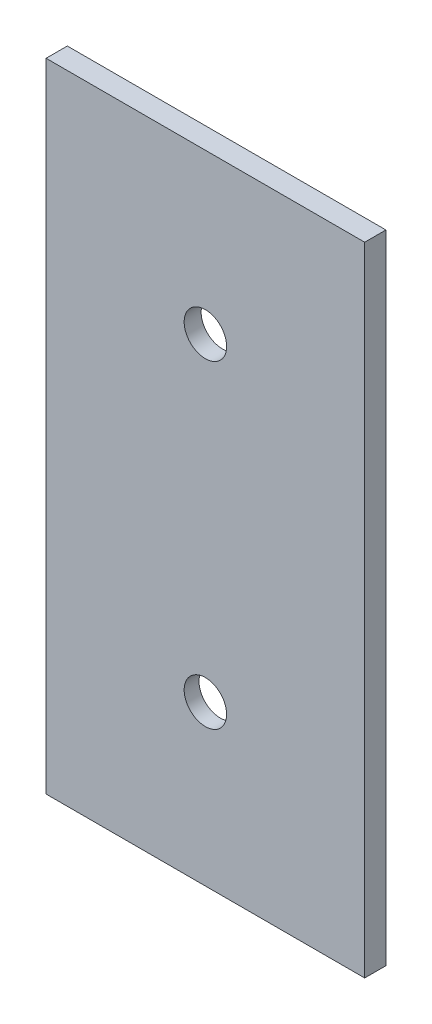
from build123d import *

# Parameters (mm, degrees)
SKETCH2_W           = 150
SKETCH2_H           = 75
SKETCH2_R           = 5
BOSS_EXTRUDE1_DEPTH = 5
SKETCH3_R           = 18.75
CUT_EXTRUDE1_DEPTH  = 1
SKETCH4_W           = 2.849358975
SKETCH4_H           = 0.75982906
SKETCH4_H_2         = 0.759829059
CUT_EXTRUDE2_DEPTH  = 1
SKETCH5_R           = 18.75
CUT_EXTRUDE3_DEPTH  = 1.5


with BuildPart() as part:
    # Sketch2 → Boss-Extrude1 (new body)
    with BuildSketch(Plane(origin=(0, 0, 0), x_dir=(0, -1, 0), z_dir=(0, 0, 1))):
        with Locations((37.5, 0)):
            Rectangle(SKETCH2_W, SKETCH2_H)
        with Locations(Location((0, 0, 0), (0, 0, 90))):
            Circle(SKETCH2_R, mode=Mode.SUBTRACT)
        with Locations(Location((75, 0, 0), (0, 0, 90))):
            Circle(SKETCH2_R, mode=Mode.SUBTRACT)
    extrude(amount=BOSS_EXTRUDE1_DEPTH)

    # Sketch3 → Cut-Extrude1 (cut)
    with BuildSketch(Plane(origin=(0, 0, 0), x_dir=(-1, 0, 0), z_dir=(0, 0, -1))):
        Circle(SKETCH3_R)
    extrude(amount=-CUT_EXTRUDE1_DEPTH, mode=Mode.SUBTRACT)

    # Sketch4 → Cut-Extrude2 (cut)
    # profile 1 of 18: a face of its own
    with BuildSketch(Plane.XY):
        Polygon((24.247508314, 33.801866182), (23.53516857, 33.801866182), (21.065724126, 27.963648367), (18.596279681, 33.801866182), (17.883939938, 33.801866182), (21.01823481, 26.393532849), (21.113213442, 26.393532849), align=None)
    # profile 2 of 18: a face of its own
    with BuildSketch(Plane.XY):
        with BuildLine():
            Line((16.269303186, 32.092250797), (16.934153613, 32.092250797))
            add(Edge.make_bspline(
                [(16.934153613, 32.092250797), (16.916141731, 32.166826222), (16.880929974, 32.312615077), (16.807486777, 32.520910445), (16.727478354, 32.718021899), (16.631404749, 32.900258588), (16.526611219, 33.071282933), (16.406548125, 33.227215913), (16.276754712, 33.372023356), (16.133191903, 33.500533042), (15.982636236, 33.616902569), (15.822966291, 33.716121441), (15.657394499, 33.801474231), (15.484773701, 33.871790388), (15.304589971, 33.92476108), (15.118472268, 33.963192985), (14.92593286, 33.988150844), (14.795233793, 33.990586625), (14.72886849, 33.991823447)],
                knots=[0, 0, 0, 0, 1.162005537, 2.271625781, 3.343758855, 4.383309926, 5.390229558, 6.379919256, 7.361854164, 8.333198761, 9.295911338, 10.242430842, 11.177959212, 12.116337295, 13.062827104, 14.020064771, 14.994644689, 16, 16, 16, 16], degree=3))
            add(Edge.make_bspline(
                [(14.72886849, 33.991823447), (14.632173353, 33.988904076), (14.44089228, 33.983129015), (14.159877164, 33.930393458), (13.888887063, 33.846943594), (13.630888155, 33.731640872), (13.391242473, 33.589427725), (13.178017544, 33.420169032), (12.99410353, 33.227130511), (12.83981043, 33.01391325), (12.719001682, 32.786042422), (12.629918859, 32.551515422), (12.5756863, 32.310888583), (12.568657789, 32.148419009), (12.565136519, 32.067022098)],
                knots=[0, 0, 0, 0, 1.083050992, 2.142477498, 3.193116406, 4.255571735, 5.30263384, 6.308962982, 7.297363603, 8.282367274, 9.249857812, 10.179914175, 11.08814088, 12, 12, 12, 12], degree=3))
            add(Edge.make_bspline(
                [(12.565136519, 32.067022098), (12.567599453, 31.988691049), (12.572419034, 31.835409342), (12.613342044, 31.611632173), (12.682210467, 31.400724119), (12.777608131, 31.201797326), (12.901097746, 31.016113082), (13.050688288, 30.843253613), (13.227435588, 30.682452228), (13.361376007, 30.59033601), (13.430332499, 30.542911855)],
                knots=[0, 0, 0, 0, 1.024540389, 2.004866551, 2.965041327, 3.920577974, 4.882998113, 5.874504559, 6.905732034, 8, 8, 8, 8], degree=3))
            add(Edge.make_bspline(
                [(13.430332499, 30.542911855), (13.351525285, 30.504858059), (13.195385402, 30.429462482), (12.982553447, 30.281601128), (12.789348611, 30.110878526), (12.681602406, 29.977649911), (12.627466247, 29.910710333)],
                knots=[0, 0, 0, 0, 1.015518401, 2.012035669, 3.001164323, 4, 4, 4, 4], degree=3))
            add(Edge.make_bspline(
                [(12.627466247, 29.910710333), (12.591818739, 29.861904758), (12.521107475, 29.765092835), (12.433825596, 29.609440733), (12.35464297, 29.452063414), (12.292941673, 29.288742672), (12.245160321, 29.121371459), (12.21100572, 28.949662388), (12.189787955, 28.77347524), (12.18674937, 28.65428049), (12.185221989, 28.594365848)],
                knots=[0, 0, 0, 0, 1.025084078, 2.033381695, 3.024893161, 4.013698104, 4.991890475, 5.976764909, 6.982997093, 8, 8, 8, 8], degree=3))
            add(Edge.make_bspline(
                [(12.185221989, 28.594365848), (12.189020376, 28.490628605), (12.196599275, 28.283642308), (12.264341232, 27.97783748), (12.369355925, 27.678910167), (12.518489773, 27.393001757), (12.700242666, 27.125496617), (12.916475669, 26.886151763), (13.1647319, 26.680414718), (13.441603857, 26.508519735), (13.741571779, 26.371110133), (14.062406782, 26.275738545), (14.399486063, 26.213622846), (14.630641509, 26.206961974), (14.748161025, 26.203575584)],
                knots=[0, 0, 0, 0, 0.955779014, 1.907060117, 2.875433937, 3.871313158, 4.872415639, 5.851225146, 6.836215519, 7.83643374, 8.849228613, 9.86973379, 10.916971861, 12, 12, 12, 12], degree=3))
            add(Edge.make_bspline(
                [(14.748161025, 26.203575584), (14.827365211, 26.205413302), (14.983212636, 26.209029318), (15.212328041, 26.233749024), (15.431025638, 26.278897535), (15.63960112, 26.339652865), (15.838239781, 26.416682052), (16.02633547, 26.51260663), (16.205045411, 26.625449309), (16.372683191, 26.75654207), (16.529228826, 26.903187572), (16.670522092, 27.067989143), (16.798918654, 27.247900315), (16.910980573, 27.445010784), (17.011812122, 27.656773245), (17.094745147, 27.885899233), (17.167739601, 28.130340413), (17.2016771, 28.300684963), (17.219089511, 28.388084131)],
                knots=[0, 0, 0, 0, 1.048658725, 2.063410685, 3.046034179, 4.001477787, 4.936774919, 5.862367409, 6.792675028, 7.730719943, 8.675894397, 9.627829632, 10.600096036, 11.597688215, 12.626045268, 13.701542398, 14.82072376, 16, 16, 16, 16], degree=3))
            Line((17.219089511, 28.388084131), (16.554239083, 28.388084131))
            add(Edge.make_bspline(
                [(16.554239083, 28.388084131), (16.536917783, 28.331042053), (16.503226349, 28.220090256), (16.445876752, 28.060408276), (16.380538909, 27.91402373), (16.310446427, 27.779862788), (16.23683205, 27.656604203), (16.154462125, 27.547507247), (16.069437434, 27.447780069), (16.005346136, 27.391593973), (15.973979, 27.364095749)],
                knots=[0, 0, 0, 0, 1.198163088, 2.33053128, 3.407730985, 4.417276592, 5.372219308, 6.28897303, 7.162600585, 8, 8, 8, 8], degree=3))
            add(Edge.make_bspline(
                [(15.973979, 27.364095749), (15.93249958, 27.332116442), (15.849668777, 27.268256542), (15.714692688, 27.186761428), (15.572738679, 27.116147258), (15.420730952, 27.062206769), (15.261949688, 27.016534053), (15.093828431, 26.986645621), (14.917850422, 26.966138992), (14.797691989, 26.964329387), (14.736288696, 26.963404643)],
                knots=[0, 0, 0, 0, 0.946170439, 1.889420265, 2.845303464, 3.807233317, 4.801018734, 5.828864929, 6.890507805, 8, 8, 8, 8], degree=3))
            add(Edge.make_bspline(
                [(14.736288696, 26.963404643), (14.666960449, 26.96470831), (14.531395046, 26.967257516), (14.33358226, 26.990701096), (14.14539483, 27.024843804), (13.968922137, 27.077576284), (13.801852563, 27.142729087), (13.646528071, 27.224534878), (13.500909646, 27.320514539), (13.366862405, 27.429605758), (13.246327747, 27.549031256), (13.140199111, 27.673942256), (13.049976911, 27.803812096), (12.977198337, 27.939359452), (12.919729672, 28.080023019), (12.880606898, 28.226197541), (12.853404524, 28.376686755), (12.851189195, 28.478983073), (12.850072416, 28.530552079)],
                knots=[0, 0, 0, 0, 1.217147791, 2.380027433, 3.494444702, 4.572153297, 5.609568379, 6.639424714, 7.649109417, 8.668170816, 9.669597737, 10.625200337, 11.543417969, 12.441394052, 13.322311151, 14.205496177, 15.095365482, 16, 16, 16, 16], degree=3))
            add(Edge.make_bspline(
                [(12.850072416, 28.530552079), (12.853311555, 28.599579413), (12.859773714, 28.737290611), (12.909110207, 28.93989281), (12.990260803, 29.135099033), (13.103867618, 29.319578788), (13.242161577, 29.490554447), (13.40380063, 29.643105751), (13.590127047, 29.768984111), (13.761619103, 29.8559551), (13.913522018, 29.915300242), (14.043517915, 29.954828917), (14.189052725, 29.988301155), (14.348366497, 30.01944213), (14.522659638, 30.04594565), (14.711742399, 30.068047493), (14.915653094, 30.08573233), (15.056816062, 30.093629815), (15.129559596, 30.097699515)],
                knots=[0, 0, 0, 0, 1.07054697, 2.135767047, 3.216561865, 4.33974944, 5.486079747, 6.621378074, 7.775625952, 8.963672916, 9.598146892, 10.304877434, 11.070270905, 11.915000392, 12.823868403, 13.805723172, 14.86925407, 16, 16, 16, 16], degree=3))
            Line((15.129559596, 30.097699515), (15.129559596, 30.857528575))
            add(Edge.make_bspline(
                [(15.129559596, 30.857528575), (15.037905462, 30.85908391), (14.858377528, 30.862130428), (14.596134583, 30.898977383), (14.345366073, 30.949948046), (14.111629469, 31.028021703), (13.898589692, 31.118700331), (13.713763201, 31.224220841), (13.559739406, 31.341515394), (13.437266805, 31.472394417), (13.345129937, 31.612761268), (13.277763216, 31.759058193), (13.237969192, 31.912567455), (13.232657064, 32.017331169), (13.229986946, 32.06999018)],
                knots=[0, 0, 0, 0, 1.321986639, 2.589447074, 3.816329219, 5.01088745, 6.139805852, 7.153945165, 8.075214402, 8.924034688, 9.728124013, 10.488707548, 11.240355623, 12, 12, 12, 12], degree=3))
            add(Edge.make_bspline(
                [(13.229986946, 32.06999018), (13.230864116, 32.108678074), (13.232609204, 32.185645804), (13.254616775, 32.298093866), (13.287687662, 32.407104202), (13.333153089, 32.512213234), (13.394007676, 32.61269198), (13.466833681, 32.70939708), (13.553549494, 32.801776412), (13.652917356, 32.887883089), (13.759622344, 32.969944641), (13.876567701, 33.039611839), (14.000227336, 33.099185554), (14.130738155, 33.148312333), (14.268523694, 33.185267827), (14.412936575, 33.211802024), (14.564252171, 33.228391727), (14.667485671, 33.230780207), (14.719964243, 33.231994387)],
                knots=[0, 0, 0, 0, 0.884392785, 1.759457502, 2.611959086, 3.489218968, 4.37281399, 5.2945488, 6.255912374, 7.266815255, 8.301784654, 9.332968512, 10.37626691, 11.440494194, 12.520033166, 13.637162961, 14.798855837, 16, 16, 16, 16], degree=3))
            add(Edge.make_bspline(
                [(14.719964243, 33.231994387), (14.804316941, 33.229049337), (14.969077377, 33.223296971), (15.206598951, 33.172913926), (15.427408208, 33.092526982), (15.596188386, 32.996572091), (15.720823168, 32.901850339), (15.809886021, 32.819125955), (15.897347768, 32.727193145), (15.97745445, 32.620389584), (16.058467701, 32.505948211), (16.132222023, 32.378051419), (16.203891705, 32.240035451), (16.247077101, 32.142466358), (16.269303186, 32.092250797)],
                knots=[0, 0, 0, 0, 1.472543308, 2.876219568, 4.221790263, 5.565193594, 6.249813518, 6.953379497, 7.687249741, 8.463570142, 9.283606569, 10.136032583, 11.040678096, 12, 12, 12, 12], degree=3))
        make_face()
    # profile 3 of 18: a face of its own
    with BuildSketch(Plane.XY):
        with BuildLine():
            add(Edge.make_bspline(
                [(10.333138656, 27.533276438), (10.291884373, 27.530824985), (10.211010176, 27.526019199), (10.094087354, 27.493048573), (9.988265324, 27.434504408), (9.894005406, 27.356478194), (9.816310031, 27.261872374), (9.755679486, 27.156894367), (9.722996067, 27.038992662), (9.718225287, 26.95764985), (9.715777545, 26.915915327)],
                knots=[0, 0, 0, 0, 1.020151414, 1.999887582, 2.974338812, 3.990962822, 5.007586832, 5.987933904, 6.967670073, 8, 8, 8, 8], degree=3))
            add(Edge.make_bspline(
                [(9.715777545, 26.915915327), (9.718308233, 26.875183613), (9.723298713, 26.794861269), (9.755604567, 26.67784884), (9.816772107, 26.572805226), (9.893469508, 26.4769157), (9.988288626, 26.398724191), (10.094337534, 26.340678111), (10.210735697, 26.305346753), (10.291838582, 26.300846091), (10.333138656, 26.298554216)],
                knots=[0, 0, 0, 0, 1.009421747, 1.99056486, 2.972319754, 3.999869655, 5.017953583, 5.993804169, 6.978383603, 8, 8, 8, 8], degree=3))
            add(Edge.make_bspline(
                [(10.333138656, 26.298554216), (10.374468489, 26.300763163), (10.455155151, 26.305075607), (10.571118839, 26.341403547), (10.677813589, 26.398179871), (10.772614245, 26.477061497), (10.84995401, 26.5723118), (10.908427737, 26.678572269), (10.943543553, 26.794526312), (10.94816185, 26.875117639), (10.950499767, 26.915915327)],
                knots=[0, 0, 0, 0, 1.022052826, 1.995314843, 2.982371812, 4.00089066, 5.028879526, 6.005146991, 6.990147033, 8, 8, 8, 8], degree=3))
            add(Edge.make_bspline(
                [(10.950499767, 26.915915327), (10.948251657, 26.957718181), (10.943862498, 27.039333122), (10.908354017, 27.156171233), (10.850407702, 27.262361096), (10.772079616, 27.356333857), (10.677836523, 27.435046981), (10.571376222, 27.492334127), (10.454875861, 27.526286333), (10.374421492, 27.530905993), (10.333138656, 27.533276438)],
                knots=[0, 0, 0, 0, 1.032775665, 2.016367738, 2.991239715, 4.008302682, 5.025365648, 6.011011707, 6.979408107, 8, 8, 8, 8], degree=3))
        make_face()
    # profile 4 of 18: a face of its own
    with BuildSketch(Plane.XY):
        with BuildLine():
            add(Edge.make_bspline(
                [(8.76599122, 30.094731433), (8.765296915, 30.213470904), (8.763948217, 30.444124037), (8.748944393, 30.780218196), (8.724019918, 31.095517474), (8.689862479, 31.390036964), (8.648295421, 31.663852699), (8.592805974, 31.916232935), (8.529702209, 32.148345769), (8.456566198, 32.360948105), (8.374042045, 32.556904243), (8.28422286, 32.739837586), (8.183544045, 32.909471343), (8.077759579, 33.068512999), (7.962587361, 33.214359153), (7.841304921, 33.349069455), (7.709178616, 33.469530544), (7.570699916, 33.579271884), (7.424615066, 33.675473265), (7.275088089, 33.760209229), (7.121089782, 33.832598948), (6.962199695, 33.889517037), (6.799845947, 33.936529996), (6.633460989, 33.968679935), (6.462770102, 33.988908725), (6.347556899, 33.990842655), (6.28912657, 33.991823447)],
                knots=[0, 0, 0, 0, 1.646270934, 3.197905019, 4.663502075, 6.030701355, 7.308322542, 8.50163776, 9.611534131, 10.641858119, 11.616356847, 12.558055219, 13.465016945, 14.349605745, 15.204443733, 16.039544428, 16.859896111, 17.680448484, 18.487036065, 19.28249412, 20.06191084, 20.843045899, 21.620316918, 22.403196591, 23.190181807, 24, 24, 24, 24], degree=3))
            add(Edge.make_bspline(
                [(6.28912657, 33.991823447), (6.23020814, 33.990790905), (6.113037922, 33.988737503), (5.939809127, 33.969001825), (5.770582301, 33.936254614), (5.606078907, 33.889855218), (5.444947686, 33.832291036), (5.288448956, 33.760139971), (5.135610634, 33.676153036), (4.988861525, 33.577465829), (4.846590589, 33.467436677), (4.712292401, 33.343055695), (4.585954736, 33.205578789), (4.465992006, 33.056476844), (4.355807659, 32.892890081), (4.250877227, 32.717663715), (4.156956418, 32.527733385), (4.066501355, 32.326268061), (3.9884239, 32.107693317), (3.918010348, 31.87324124), (3.861116531, 31.620142545), (3.813725904, 31.349725159), (3.777012541, 31.060995986), (3.750273449, 30.754573952), (3.736148752, 30.430257458), (3.733488735, 30.208520011), (3.732123699, 30.094731433)],
                knots=[0, 0, 0, 0, 0.810914788, 1.612654377, 2.396697861, 3.181598691, 3.963628158, 4.749916497, 5.551656086, 6.361998678, 7.18212741, 8.025565596, 8.878627764, 9.750805457, 10.657531673, 11.591944965, 12.560506719, 13.57287815, 14.630710178, 15.753379473, 16.941251878, 18.199788006, 19.531962791, 20.947069417, 22.433333509, 24, 24, 24, 24], degree=3))
            add(Edge.make_bspline(
                [(3.732123699, 30.094731433), (3.733502886, 29.981439161), (3.736190176, 29.76069379), (3.750115105, 29.437836559), (3.777544208, 29.1330407), (3.81185535, 28.845575221), (3.859376555, 28.576636595), (3.91780749, 28.325294179), (3.982684007, 28.090462561), (4.062767654, 27.874065543), (4.150420325, 27.673084396), (4.245787156, 27.485405599), (4.347958288, 27.309370279), (4.459271132, 27.146387482), (4.577917523, 26.995302657), (4.706436843, 26.858782689), (4.841206248, 26.7335381), (4.983895861, 26.622092156), (5.132933645, 26.524545986), (5.285247024, 26.437310003), (5.443538519, 26.366967465), (5.604220936, 26.306568295), (5.769592644, 26.260424005), (5.939447504, 26.228517677), (6.112921537, 26.206140598), (6.230188183, 26.204433549), (6.28912657, 26.203575584)],
                knots=[0, 0, 0, 0, 1.561518951, 3.042555995, 4.452378317, 5.7783523, 7.031515105, 8.214008947, 9.334062868, 10.386615937, 11.391082383, 12.354592575, 13.286541444, 14.194233754, 15.072674879, 15.931287219, 16.775624067, 17.606195743, 18.42308326, 19.229000347, 20.022332153, 20.807536673, 21.593273796, 22.3848459, 23.188221202, 24, 24, 24, 24], degree=3))
            add(Edge.make_bspline(
                [(6.28912657, 26.203575584), (6.347555278, 26.204562703), (6.462765285, 26.206509109), (6.633479586, 26.226646507), (6.799177424, 26.259021989), (6.960676454, 26.304353801), (7.118805244, 26.359841871), (7.271409051, 26.432133835), (7.420184648, 26.515390947), (7.564735108, 26.610207923), (7.702344182, 26.718838819), (7.83378623, 26.838989896), (7.955759187, 26.97365945), (8.06928469, 27.120721054), (8.177179843, 27.27882175), (8.276429017, 27.45012014), (8.368230658, 27.633936999), (8.452142713, 27.83145991), (8.526540717, 28.045571174), (8.592258366, 28.278720268), (8.644146666, 28.532965031), (8.688560588, 28.806263459), (8.724383866, 29.099789944), (8.748840521, 29.413703842), (8.763956304, 29.747809534), (8.765300537, 29.976980556), (8.76599122, 30.094731433)],
                knots=[0, 0, 0, 0, 0.810891512, 1.598919785, 2.382837074, 3.152667961, 3.926044502, 4.706494248, 5.493654104, 6.291793342, 7.103789334, 7.925228297, 8.761435821, 9.622817696, 10.50288917, 11.416980706, 12.369136599, 13.353924996, 14.394355917, 15.514179734, 16.714354668, 17.994756427, 19.357759367, 20.818452758, 22.365282078, 24, 24, 24, 24], degree=3))
        make_face()
        with BuildLine():
            add(Edge.make_bspline(
                [(8.101140793, 30.097699515), (8.100887963, 29.998748103), (8.10039727, 29.806702841), (8.087578312, 29.527634606), (8.070115321, 29.26734741), (8.047591242, 29.025510757), (8.014141668, 28.802943231), (7.9766623, 28.598114068), (7.931052177, 28.41210725), (7.877087723, 28.243646384), (7.815621634, 28.089872522), (7.74851089, 27.946783284), (7.676415693, 27.812688351), (7.595730157, 27.688792214), (7.507856607, 27.574690833), (7.414779875, 27.468364671), (7.313026238, 27.373544394), (7.172259983, 27.259822551), (6.986424113, 27.142307051), (6.752277482, 27.039974494), (6.511679261, 26.975664962), (6.348375782, 26.967486678), (6.266865953, 26.963404643)],
                knots=[0, 0, 0, 0, 1.459021318, 2.831673884, 4.118529203, 5.306027144, 6.411944654, 7.436330062, 8.375795394, 9.233974572, 10.042671642, 10.816086306, 11.563610507, 12.285937304, 12.993564865, 13.685989202, 14.367179055, 15.041617293, 16.353048772, 17.594441528, 18.799311195, 20, 20, 20, 20], degree=3))
            add(Edge.make_bspline(
                [(6.266865953, 26.963404643), (6.184828881, 26.966786613), (6.020924114, 26.973543569), (5.781457581, 27.03873423), (5.548983509, 27.137094755), (5.366797902, 27.253400308), (5.228193185, 27.364161939), (5.128885556, 27.458596278), (5.037737553, 27.564336197), (4.951288495, 27.67842304), (4.872000118, 27.803036465), (4.79989981, 27.937577249), (4.734106724, 28.082419009), (4.696622577, 28.183531623), (4.6774579, 28.235227894)],
                knots=[0, 0, 0, 0, 1.353760809, 2.704726607, 4.075137775, 5.516104923, 6.260822281, 7.007110065, 7.778089737, 8.566572457, 9.372053459, 10.217411131, 11.088608312, 12, 12, 12, 12], degree=3))
            add(Edge.make_bspline(
                [(4.6774579, 28.235227894), (4.655123325, 28.301330843), (4.609774559, 28.435548177), (4.551329637, 28.64375124), (4.505301875, 28.862197091), (4.463892751, 29.089580254), (4.435628782, 29.327577622), (4.412879244, 29.575452801), (4.39947929, 29.833392684), (4.397818234, 30.008642082), (4.396974126, 30.097699515)],
                knots=[0, 0, 0, 0, 0.884706709, 1.796334032, 2.740027952, 3.714592787, 4.726048262, 5.777819803, 6.87074269, 8, 8, 8, 8], degree=3))
            add(Edge.make_bspline(
                [(4.396974126, 30.097699515), (4.398138693, 30.186742544), (4.400416836, 30.360929743), (4.409124776, 30.616026558), (4.431611342, 30.858316652), (4.456586144, 31.088843819), (4.493410262, 31.30633196), (4.533114286, 31.512601773), (4.586456852, 31.705097842), (4.643437043, 31.886833957), (4.70865238, 32.055745342), (4.780440684, 32.212619523), (4.857110073, 32.358213857), (4.940384482, 32.492128884), (5.029275345, 32.614964433), (5.126128824, 32.724257658), (5.22710308, 32.823395907), (5.36853279, 32.936558345), (5.553686703, 33.051941434), (5.784076657, 33.158125625), (6.023832854, 33.219103178), (6.185913332, 33.227700416), (6.266865953, 33.231994387)],
                knots=[0, 0, 0, 0, 1.31362396, 2.569729283, 3.763502607, 4.902122613, 5.988968491, 7.01645872, 7.998833611, 8.933434873, 9.825090667, 10.667526885, 11.477055099, 12.250526234, 12.991942729, 13.710640831, 14.402115721, 15.076753259, 16.378508321, 17.609869233, 18.806226677, 20, 20, 20, 20], degree=3))
            add(Edge.make_bspline(
                [(6.266865953, 33.231994387), (6.348803373, 33.227694492), (6.512827483, 33.219086867), (6.755075654, 33.158352814), (6.987283198, 33.052492036), (7.171947494, 32.936176181), (7.313475843, 32.825393422), (7.41313421, 32.729325427), (7.506576941, 32.624240856), (7.592656907, 32.509090136), (7.673279223, 32.385338442), (7.747322366, 32.252012223), (7.814034047, 32.108435835), (7.875596315, 31.954731047), (7.929725383, 31.786284715), (7.974374272, 31.600507012), (8.015621868, 31.396329341), (8.044821854, 31.172556382), (8.070780137, 30.930659158), (8.087462323, 30.669722167), (8.100440152, 30.390185895), (8.100902568, 30.197147677), (8.101140793, 30.097699515)],
                knots=[0, 0, 0, 0, 1.207732386, 2.417664972, 3.655092373, 4.956220595, 5.625982001, 6.301752483, 6.994047911, 7.697131622, 8.419323945, 9.170223765, 9.943494443, 10.752040957, 11.610060368, 12.549350801, 13.567764191, 14.679664412, 15.874934091, 17.154273443, 18.533957287, 20, 20, 20, 20], degree=3))
        make_face(mode=Mode.SUBTRACT)
    # profile 5 of 18: a face of its own
    with BuildSketch(Plane.XY):
        with Locations((-1.206765191, 29.242891823)):
            Rectangle(SKETCH4_W, SKETCH4_H)
    # profile 6 of 18: a face of its own
    with BuildSketch(Plane.XY):
        Polygon((-7.625243088, 33.801866182), (-8.995013054, 33.801866182), (-8.995013054, 26.393532849), (-8.330162626, 26.393532849), (-8.330162626, 33.042037122), (-7.190419037, 33.042037122), align=None)
    # profile 7 of 18: a face of its own
    with BuildSketch(Plane.XY):
        with BuildLine():
            Line((-12.224286558, 31.8073149), (-12.889136985, 31.8073149))
            Line((-12.889136985, 31.8073149), (-12.889136985, 30.866432822))
            add(Edge.make_bspline(
                [(-12.889136985, 30.866432822), (-12.949004679, 30.948744912), (-13.06371692, 31.106462769), (-13.251815885, 31.31429887), (-13.439725323, 31.490676797), (-13.575050981, 31.583265876), (-13.640061798, 31.627745923)],
                knots=[0, 0, 0, 0, 1.134379233, 2.173579362, 3.122582517, 4, 4, 4, 4], degree=3))
            add(Edge.make_bspline(
                [(-13.640061798, 31.627745923), (-13.728675333, 31.670090613), (-13.904354221, 31.754040181), (-14.182524914, 31.839201214), (-14.467162964, 31.891536012), (-14.659373684, 31.898693252), (-14.75606073, 31.902293532)],
                knots=[0, 0, 0, 0, 1.014936303, 2.012140481, 3.000054389, 4, 4, 4, 4], degree=3))
            add(Edge.make_bspline(
                [(-14.75606073, 31.902293532), (-14.821450906, 31.900081), (-14.950854548, 31.895702518), (-15.142590872, 31.86721211), (-15.328558267, 31.817965377), (-15.507657963, 31.749369875), (-15.676400067, 31.666297721), (-15.831105536, 31.568825839), (-15.97001011, 31.459400363), (-16.093043585, 31.333079955), (-16.203679689, 31.186317488), (-16.305446581, 31.015154828), (-16.399479947, 30.815748612), (-16.451595051, 30.671039433), (-16.479032485, 30.594853295)],
                knots=[0, 0, 0, 0, 1.009824226, 1.998387844, 2.986035974, 3.974953746, 4.955485308, 5.885931332, 6.793869504, 7.679848016, 8.601185859, 9.625726857, 10.749998409, 12, 12, 12, 12], degree=3))
            add(Edge.make_bspline(
                [(-16.479032485, 30.594853295), (-16.508054633, 30.647186649), (-16.565166146, 30.75017134), (-16.661063078, 30.895921329), (-16.761536581, 31.032249038), (-16.867442924, 31.159262636), (-16.9784083, 31.276334899), (-17.09495493, 31.383852891), (-17.216419384, 31.482278343), (-17.385312959, 31.597262364), (-17.605049645, 31.719396531), (-17.882096154, 31.825290071), (-18.170280684, 31.89072921), (-18.365898145, 31.898413287), (-18.46467952, 31.902293532)],
                knots=[0, 0, 0, 0, 0.86119277, 1.694706429, 2.50939023, 3.298075842, 4.073795165, 4.829715201, 5.57930267, 6.321991688, 7.768977793, 9.186738141, 10.579381044, 12, 12, 12, 12], degree=3))
            add(Edge.make_bspline(
                [(-18.46467952, 31.902293532), (-18.555445283, 31.898870415), (-18.733082694, 31.892171042), (-18.99169124, 31.839564523), (-19.232868061, 31.74923017), (-19.456127872, 31.625968973), (-19.657549477, 31.471073035), (-19.832632331, 31.286777328), (-19.980312934, 31.074385443), (-20.076787721, 30.874589067), (-20.142225031, 30.698195946), (-20.18257131, 30.547899296), (-20.218215331, 30.382478509), (-20.247808967, 30.201735788), (-20.269438236, 30.005032668), (-20.285462917, 29.792691047), (-20.296308872, 29.564545894), (-20.297075259, 29.407138919), (-20.297470319, 29.325998126)],
                knots=[0, 0, 0, 0, 1.209669288, 2.367440248, 3.500751976, 4.631527125, 5.755587489, 6.87532382, 8.007944318, 9.190864318, 9.82315674, 10.514484317, 11.263564316, 12.079023757, 12.955305781, 13.901327259, 14.918167583, 16, 16, 16, 16], degree=3))
            Line((-20.297470319, 29.325998126), (-20.297470319, 26.393532849))
            Line((-20.297470319, 26.393532849), (-19.632619891, 26.393532849))
            Line((-19.632619891, 26.393532849), (-19.632619891, 29.328966209))
            add(Edge.make_bspline(
                [(-19.632619891, 29.328966209), (-19.632455039, 29.398224757), (-19.632138218, 29.531329153), (-19.626436698, 29.722363508), (-19.61569395, 29.896498198), (-19.603132298, 30.053495784), (-19.585682901, 30.193722387), (-19.563149012, 30.316896339), (-19.539277923, 30.423986573), (-19.499620075, 30.542702041), (-19.436230371, 30.673660653), (-19.339673372, 30.814892222), (-19.218028314, 30.937829916), (-19.077565982, 31.044548686), (-18.917655108, 31.13131856), (-18.741411444, 31.193286114), (-18.549929201, 31.231646206), (-18.417377632, 31.235468939), (-18.348924312, 31.237443105)],
                knots=[0, 0, 0, 0, 1.253487763, 2.409012846, 3.458416907, 4.410876679, 5.259312806, 6.014470957, 6.676830364, 7.243083969, 8.276244668, 9.299465089, 10.325150304, 11.392391894, 12.482080715, 13.603491619, 14.762376348, 16, 16, 16, 16], degree=3))
            add(Edge.make_bspline(
                [(-18.348924312, 31.237443105), (-18.264956242, 31.234445572), (-18.099003413, 31.228521307), (-17.856760467, 31.168039942), (-17.623988482, 31.076853412), (-17.407633117, 30.944704711), (-17.208607627, 30.786360341), (-17.037370187, 30.598083696), (-16.895908728, 30.385083684), (-16.800121145, 30.187923164), (-16.739607124, 30.010822842), (-16.699650986, 29.856100071), (-16.668571141, 29.680244086), (-16.639423521, 29.484436563), (-16.620399496, 29.267329682), (-16.603109775, 29.029927733), (-16.595022282, 28.771516685), (-16.593891011, 28.592390194), (-16.593303652, 28.499387216)],
                knots=[0, 0, 0, 0, 1.090531906, 2.155305635, 3.229839962, 4.33261226, 5.44038871, 6.529323825, 7.629011124, 8.757537029, 9.370236727, 10.061839251, 10.834451254, 11.692844982, 12.636905849, 13.66920014, 14.789842145, 16, 16, 16, 16], degree=3))
            Line((-16.593303652, 28.499387216), (-16.593303652, 26.393532849))
            Line((-16.593303652, 26.393532849), (-15.928453225, 26.393532849))
            Line((-15.928453225, 26.393532849), (-15.928453225, 29.146429149))
            add(Edge.make_bspline(
                [(-15.928453225, 29.146429149), (-15.928285096, 29.224096674), (-15.927961633, 29.373521185), (-15.922296761, 29.587799131), (-15.911530078, 29.782704084), (-15.899082918, 29.958009516), (-15.88117554, 30.113396828), (-15.860834877, 30.249699066), (-15.836813651, 30.366574523), (-15.797041729, 30.494767021), (-15.736262771, 30.635992974), (-15.638497616, 30.786574802), (-15.516561571, 30.918375609), (-15.37353655, 31.03089496), (-15.212657856, 31.123904428), (-15.034892991, 31.19091757), (-14.841842593, 31.229915649), (-14.708751448, 31.234886634), (-14.640305522, 31.237443105)],
                knots=[0, 0, 0, 0, 1.320475261, 2.540461679, 3.643808994, 4.639130445, 5.527981419, 6.302341397, 6.981980563, 7.553956391, 8.582137848, 9.585246428, 10.591171744, 11.620968678, 12.668337649, 13.738356861, 14.836885341, 16, 16, 16, 16], degree=3))
            add(Edge.make_bspline(
                [(-14.640305522, 31.237443105), (-14.559837874, 31.234203631), (-14.39946871, 31.227747475), (-14.163879541, 31.169635929), (-13.936368177, 31.078610637), (-13.720564065, 30.952330687), (-13.522287117, 30.795910971), (-13.348702952, 30.611941108), (-13.202774606, 30.402710654), (-13.105975598, 30.207629094), (-13.043537161, 30.034965662), (-13.002060369, 29.888172823), (-12.966416495, 29.725188964), (-12.939928482, 29.545511245), (-12.914358269, 29.350309929), (-12.902017448, 29.138612593), (-12.890012641, 28.91060084), (-12.88943603, 28.753178953), (-12.889136985, 28.671535987)],
                knots=[0, 0, 0, 0, 1.098833095, 2.189935336, 3.297829714, 4.440610912, 5.596351641, 6.740013378, 7.886572111, 9.072425424, 9.705826452, 10.395263256, 11.156850408, 11.985370555, 12.878090359, 13.847760091, 14.883794034, 16, 16, 16, 16], degree=3))
            Line((-12.889136985, 28.671535987), (-12.889136985, 26.393532849))
            Line((-12.889136985, 26.393532849), (-12.224286558, 26.393532849))
            Line((-12.224286558, 26.393532849), (-12.224286558, 31.8073149))
        make_face()
    # profile 8 of 18: a face of its own
    with BuildSketch(Plane.XY):
        with BuildLine():
            Line((-21.817128438, 31.8073149), (-22.481978866, 31.8073149))
            Line((-22.481978866, 31.8073149), (-22.481978866, 30.866432822))
            add(Edge.make_bspline(
                [(-22.481978866, 30.866432822), (-22.54184656, 30.948744912), (-22.656558801, 31.106462769), (-22.844657765, 31.31429887), (-23.032567203, 31.490676797), (-23.167892861, 31.583265876), (-23.232903679, 31.627745923)],
                knots=[0, 0, 0, 0, 1.134379233, 2.173579362, 3.122582517, 4, 4, 4, 4], degree=3))
            add(Edge.make_bspline(
                [(-23.232903679, 31.627745923), (-23.321517214, 31.670090613), (-23.497196101, 31.754040181), (-23.775366794, 31.839201214), (-24.060004845, 31.891536012), (-24.252215564, 31.898693252), (-24.34890261, 31.902293532)],
                knots=[0, 0, 0, 0, 1.014936303, 2.012140481, 3.000054389, 4, 4, 4, 4], degree=3))
            add(Edge.make_bspline(
                [(-24.34890261, 31.902293532), (-24.414292786, 31.900081), (-24.543696429, 31.895702518), (-24.735432753, 31.86721211), (-24.921400148, 31.817965377), (-25.100499843, 31.749369875), (-25.269241948, 31.666297721), (-25.423947416, 31.568825839), (-25.56285199, 31.459400363), (-25.685885465, 31.333079955), (-25.796521569, 31.186317488), (-25.898288461, 31.015154828), (-25.992321827, 30.815748612), (-26.044436931, 30.671039433), (-26.071874365, 30.594853295)],
                knots=[0, 0, 0, 0, 1.009824226, 1.998387844, 2.986035974, 3.974953746, 4.955485308, 5.885931332, 6.793869504, 7.679848016, 8.601185859, 9.625726857, 10.749998409, 12, 12, 12, 12], degree=3))
            add(Edge.make_bspline(
                [(-26.071874365, 30.594853295), (-26.100896514, 30.647186649), (-26.158008027, 30.75017134), (-26.253904958, 30.895921329), (-26.354378461, 31.032249038), (-26.460284805, 31.159262636), (-26.57125018, 31.276334899), (-26.687796811, 31.383852891), (-26.809261265, 31.482278343), (-26.978154839, 31.597262364), (-27.197891525, 31.719396531), (-27.474938034, 31.825290071), (-27.763122564, 31.89072921), (-27.958740026, 31.898413287), (-28.0575214, 31.902293532)],
                knots=[0, 0, 0, 0, 0.86119277, 1.694706429, 2.50939023, 3.298075842, 4.073795165, 4.829715201, 5.57930267, 6.321991688, 7.768977793, 9.186738141, 10.579381044, 12, 12, 12, 12], degree=3))
            add(Edge.make_bspline(
                [(-28.0575214, 31.902293532), (-28.148287163, 31.898870415), (-28.325924574, 31.892171042), (-28.58453312, 31.839564523), (-28.825709941, 31.74923017), (-29.048969752, 31.625968973), (-29.250391357, 31.471073035), (-29.425474212, 31.286777328), (-29.573154814, 31.074385443), (-29.669629602, 30.874589067), (-29.735066911, 30.698195946), (-29.77541319, 30.547899296), (-29.811057211, 30.382478509), (-29.840650847, 30.201735788), (-29.862280116, 30.005032668), (-29.878304797, 29.792691047), (-29.889150753, 29.564545894), (-29.889917139, 29.407138919), (-29.890312199, 29.325998126)],
                knots=[0, 0, 0, 0, 1.209669288, 2.367440248, 3.500751976, 4.631527125, 5.755587489, 6.87532382, 8.007944318, 9.190864318, 9.82315674, 10.514484317, 11.263564316, 12.079023757, 12.955305781, 13.901327259, 14.918167583, 16, 16, 16, 16], degree=3))
            Line((-29.890312199, 29.325998126), (-29.890312199, 26.393532849))
            Line((-29.890312199, 26.393532849), (-29.225461772, 26.393532849))
            Line((-29.225461772, 26.393532849), (-29.225461772, 29.328966209))
            add(Edge.make_bspline(
                [(-29.225461772, 29.328966209), (-29.225296919, 29.398224757), (-29.224980098, 29.531329153), (-29.219278578, 29.722363508), (-29.20853583, 29.896498198), (-29.195974178, 30.053495784), (-29.178524781, 30.193722387), (-29.155990893, 30.316896339), (-29.132119803, 30.423986573), (-29.092461956, 30.542702041), (-29.029072252, 30.673660653), (-28.932515252, 30.814892222), (-28.810870194, 30.937829916), (-28.670407863, 31.044548686), (-28.510496988, 31.13131856), (-28.334253324, 31.193286114), (-28.142771081, 31.231646206), (-28.010219513, 31.235468939), (-27.941766192, 31.237443105)],
                knots=[0, 0, 0, 0, 1.253487763, 2.409012846, 3.458416907, 4.410876679, 5.259312806, 6.014470957, 6.676830364, 7.243083969, 8.276244668, 9.299465089, 10.325150304, 11.392391894, 12.482080715, 13.603491619, 14.762376348, 16, 16, 16, 16], degree=3))
            add(Edge.make_bspline(
                [(-27.941766192, 31.237443105), (-27.857798122, 31.234445572), (-27.691845293, 31.228521307), (-27.449602347, 31.168039942), (-27.216830362, 31.076853412), (-27.000474998, 30.944704711), (-26.801449507, 30.786360341), (-26.630212068, 30.598083696), (-26.488750608, 30.385083684), (-26.392963026, 30.187923164), (-26.332449005, 30.010822842), (-26.292492866, 29.856100071), (-26.261413021, 29.680244086), (-26.232265401, 29.484436563), (-26.213241377, 29.267329682), (-26.195951655, 29.029927733), (-26.187864162, 28.771516685), (-26.186732891, 28.592390194), (-26.186145532, 28.499387216)],
                knots=[0, 0, 0, 0, 1.090531906, 2.155305635, 3.229839962, 4.33261226, 5.44038871, 6.529323825, 7.629011124, 8.757537029, 9.370236727, 10.061839251, 10.834451254, 11.692844982, 12.636905849, 13.66920014, 14.789842145, 16, 16, 16, 16], degree=3))
            Line((-26.186145532, 28.499387216), (-26.186145532, 26.393532849))
            Line((-26.186145532, 26.393532849), (-25.521295105, 26.393532849))
            Line((-25.521295105, 26.393532849), (-25.521295105, 29.146429149))
            add(Edge.make_bspline(
                [(-25.521295105, 29.146429149), (-25.521126976, 29.224096674), (-25.520803513, 29.373521185), (-25.515138641, 29.587799131), (-25.504371959, 29.782704084), (-25.491924798, 29.958009516), (-25.47401742, 30.113396828), (-25.453676757, 30.249699066), (-25.429655531, 30.366574523), (-25.389883609, 30.494767021), (-25.329104651, 30.635992974), (-25.231339496, 30.786574802), (-25.109403451, 30.918375609), (-24.966378431, 31.03089496), (-24.805499737, 31.123904428), (-24.627734872, 31.19091757), (-24.434684473, 31.229915649), (-24.301593329, 31.234886634), (-24.233147402, 31.237443105)],
                knots=[0, 0, 0, 0, 1.320475261, 2.540461679, 3.643808994, 4.639130445, 5.527981419, 6.302341397, 6.981980563, 7.553956391, 8.582137848, 9.585246428, 10.591171744, 11.620968678, 12.668337649, 13.738356861, 14.836885341, 16, 16, 16, 16], degree=3))
            add(Edge.make_bspline(
                [(-24.233147402, 31.237443105), (-24.152679754, 31.234203631), (-23.99231059, 31.227747475), (-23.756721421, 31.169635929), (-23.529210057, 31.078610637), (-23.313405945, 30.952330687), (-23.115128998, 30.795910971), (-22.941544832, 30.611941108), (-22.795616486, 30.402710654), (-22.698817478, 30.207629094), (-22.636379041, 30.034965662), (-22.594902249, 29.888172823), (-22.559258375, 29.725188964), (-22.532770362, 29.545511245), (-22.507200149, 29.350309929), (-22.494859328, 29.138612593), (-22.482854522, 28.91060084), (-22.482277911, 28.753178953), (-22.481978866, 28.671535987)],
                knots=[0, 0, 0, 0, 1.098833095, 2.189935336, 3.297829714, 4.440610912, 5.596351641, 6.740013378, 7.886572111, 9.072425424, 9.705826452, 10.395263256, 11.156850408, 11.985370555, 12.878090359, 13.847760091, 14.883794034, 16, 16, 16, 16], degree=3))
            Line((-22.481978866, 28.671535987), (-22.481978866, 26.393532849))
            Line((-22.481978866, 26.393532849), (-21.817128438, 26.393532849))
            Line((-21.817128438, 26.393532849), (-21.817128438, 31.8073149))
        make_face()
    # profile 9 of 18: a face of its own
    with BuildSketch(Plane.XY):
        Polygon((33.711136971, -99.073673628), (32.998797227, -99.073673628), (30.529352783, -104.911891443), (28.059908338, -99.073673628), (27.347568595, -99.073673628), (30.481863466, -106.482006961), (30.576842099, -106.482006961), align=None)
    # profile 10 of 18: a face of its own
    with BuildSketch(Plane.XY):
        with BuildLine():
            Line((25.732931843, -100.783289012), (26.39778227, -100.783289012))
            add(Edge.make_bspline(
                [(26.39778227, -100.783289012), (26.379770388, -100.708713588), (26.344558631, -100.562924733), (26.271115434, -100.354629364), (26.19110701, -100.15751791), (26.095033406, -99.975281221), (25.990239876, -99.804256877), (25.870176782, -99.648323897), (25.740383369, -99.503516453), (25.59682056, -99.375006767), (25.446264893, -99.25863724), (25.286594948, -99.159418369), (25.121023156, -99.074065579), (24.948402358, -99.003749421), (24.768218628, -98.950778729), (24.582100925, -98.912346824), (24.389561517, -98.887388966), (24.25886245, -98.884953184), (24.192497147, -98.883716363)],
                knots=[0, 0, 0, 0, 1.162005537, 2.271625781, 3.343758855, 4.383309926, 5.390229558, 6.379919256, 7.361854164, 8.333198761, 9.295911338, 10.242430842, 11.177959212, 12.116337295, 13.062827104, 14.020064771, 14.994644689, 16, 16, 16, 16], degree=3))
            add(Edge.make_bspline(
                [(24.192497147, -98.883716363), (24.09580201, -98.886635733), (23.904520936, -98.892410795), (23.62350582, -98.945146352), (23.35251572, -99.028596215), (23.094516812, -99.143898938), (22.85487113, -99.286112084), (22.641646201, -99.455370777), (22.457732187, -99.648409299), (22.303439087, -99.86162656), (22.182630339, -100.089497388), (22.093547515, -100.324024387), (22.039314957, -100.564651227), (22.032286445, -100.727120801), (22.028765176, -100.808517711)],
                knots=[0, 0, 0, 0, 1.083050992, 2.142477498, 3.193116406, 4.255571735, 5.30263384, 6.308962982, 7.297363603, 8.282367274, 9.249857812, 10.179914175, 11.08814088, 12, 12, 12, 12], degree=3))
            add(Edge.make_bspline(
                [(22.028765176, -100.808517711), (22.03122811, -100.88684876), (22.036047691, -101.040130467), (22.076970701, -101.263907636), (22.145839124, -101.47481569), (22.241236788, -101.673742483), (22.364726403, -101.859426728), (22.514316944, -102.032286196), (22.691064245, -102.193087581), (22.825004664, -102.285203799), (22.893961156, -102.332627954)],
                knots=[0, 0, 0, 0, 1.024540389, 2.004866551, 2.965041327, 3.920577974, 4.882998113, 5.874504559, 6.905732034, 8, 8, 8, 8], degree=3))
            add(Edge.make_bspline(
                [(22.893961156, -102.332627954), (22.815153942, -102.370681751), (22.659014058, -102.446077328), (22.446182104, -102.593938681), (22.252977268, -102.764661283), (22.145231063, -102.897889899), (22.091094903, -102.964829477)],
                knots=[0, 0, 0, 0, 1.015518401, 2.012035669, 3.001164323, 4, 4, 4, 4], degree=3))
            add(Edge.make_bspline(
                [(22.091094903, -102.964829477), (22.055447395, -103.013635051), (21.984736132, -103.110446975), (21.897454252, -103.266099076), (21.818271627, -103.423476395), (21.756570329, -103.586797138), (21.708788978, -103.75416835), (21.674634376, -103.925877422), (21.653416612, -104.102064569), (21.650378026, -104.221259319), (21.648850646, -104.281173961)],
                knots=[0, 0, 0, 0, 1.025084078, 2.033381695, 3.024893161, 4.013698104, 4.991890475, 5.976764909, 6.982997093, 8, 8, 8, 8], degree=3))
            add(Edge.make_bspline(
                [(21.648850646, -104.281173961), (21.652649033, -104.384911205), (21.660227932, -104.591897502), (21.727969889, -104.897702329), (21.832984582, -105.196629642), (21.982118429, -105.482538052), (22.163871323, -105.750043192), (22.380104326, -105.989388046), (22.628360557, -106.195125092), (22.905232514, -106.367020075), (23.205200436, -106.504429677), (23.526035439, -106.599801264), (23.86311472, -106.661916963), (24.094270166, -106.668577836), (24.211789682, -106.671964226)],
                knots=[0, 0, 0, 0, 0.955779014, 1.907060117, 2.875433937, 3.871313158, 4.872415639, 5.851225146, 6.836215519, 7.83643374, 8.849228613, 9.86973379, 10.916971861, 12, 12, 12, 12], degree=3))
            add(Edge.make_bspline(
                [(24.211789682, -106.671964226), (24.290993867, -106.670126508), (24.446841293, -106.666510491), (24.675956698, -106.641790786), (24.894654295, -106.596642275), (25.103229777, -106.535886945), (25.301868437, -106.458857757), (25.489964127, -106.36293318), (25.668674068, -106.250090501), (25.836311848, -106.11899774), (25.992857483, -105.972352237), (26.134150749, -105.807550666), (26.262547311, -105.627639495), (26.37460923, -105.430529026), (26.475440779, -105.218766564), (26.558373804, -104.989640576), (26.631368258, -104.745199396), (26.665305757, -104.574854846), (26.682718167, -104.487455679)],
                knots=[0, 0, 0, 0, 1.048658725, 2.063410685, 3.046034179, 4.001477787, 4.936774919, 5.862367409, 6.792675028, 7.730719943, 8.675894397, 9.627829632, 10.600096036, 11.597688215, 12.626045268, 13.701542398, 14.82072376, 16, 16, 16, 16], degree=3))
            Line((26.682718167, -104.487455679), (26.01786774, -104.487455679))
            add(Edge.make_bspline(
                [(26.01786774, -104.487455679), (26.00054644, -104.544497757), (25.966855006, -104.655449554), (25.909505409, -104.815131534), (25.844167566, -104.96151608), (25.774075084, -105.095677021), (25.700460706, -105.218935607), (25.618090781, -105.328032563), (25.533066091, -105.427759741), (25.468974793, -105.483945836), (25.437607657, -105.51144406)],
                knots=[0, 0, 0, 0, 1.198163088, 2.33053128, 3.407730985, 4.417276592, 5.372219308, 6.28897303, 7.162600585, 8, 8, 8, 8], degree=3))
            add(Edge.make_bspline(
                [(25.437607657, -105.51144406), (25.396128237, -105.543423367), (25.313297434, -105.607283268), (25.178321345, -105.688778381), (25.036367336, -105.759392552), (24.884359609, -105.813333041), (24.725578344, -105.859005756), (24.557457088, -105.888894188), (24.381479079, -105.909400818), (24.261320646, -105.911210423), (24.199917353, -105.912135166)],
                knots=[0, 0, 0, 0, 0.946170439, 1.889420265, 2.845303464, 3.807233317, 4.801018734, 5.828864929, 6.890507805, 8, 8, 8, 8], degree=3))
            add(Edge.make_bspline(
                [(24.199917353, -105.912135166), (24.130589105, -105.9108315), (23.995023703, -105.908282293), (23.797210917, -105.884838714), (23.609023486, -105.850696005), (23.432550794, -105.797963525), (23.26548122, -105.732810723), (23.110156728, -105.651004931), (22.964538303, -105.555025271), (22.830491062, -105.445934051), (22.709956404, -105.326508554), (22.603827768, -105.201597553), (22.513605568, -105.071727714), (22.440826994, -104.936180358), (22.383358329, -104.79551679), (22.344235555, -104.649342268), (22.317033181, -104.498853055), (22.314817852, -104.396556737), (22.313701073, -104.34498773)],
                knots=[0, 0, 0, 0, 1.217147791, 2.380027433, 3.494444702, 4.572153297, 5.609568379, 6.639424714, 7.649109417, 8.668170816, 9.669597737, 10.625200337, 11.543417969, 12.441394052, 13.322311151, 14.205496177, 15.095365482, 16, 16, 16, 16], degree=3))
            add(Edge.make_bspline(
                [(22.313701073, -104.34498773), (22.316940212, -104.275960396), (22.32340237, -104.138249199), (22.372738864, -103.935647), (22.45388946, -103.740440777), (22.567496275, -103.555961021), (22.705790234, -103.384985363), (22.867429287, -103.232434058), (23.053755704, -103.106555699), (23.22524776, -103.01958471), (23.377150674, -102.960239567), (23.507146571, -102.920710892), (23.652681382, -102.887238655), (23.811995154, -102.85609768), (23.986288295, -102.82959416), (24.175371056, -102.807492316), (24.379281751, -102.78980748), (24.520444719, -102.781909995), (24.593188253, -102.777840294)],
                knots=[0, 0, 0, 0, 1.07054697, 2.135767047, 3.216561865, 4.33974944, 5.486079747, 6.621378074, 7.775625952, 8.963672916, 9.598146892, 10.304877434, 11.070270905, 11.915000392, 12.823868403, 13.805723172, 14.86925407, 16, 16, 16, 16], degree=3))
            Line((24.593188253, -102.777840294), (24.593188253, -102.018011234))
            add(Edge.make_bspline(
                [(24.593188253, -102.018011234), (24.501534119, -102.0164559), (24.322006185, -102.013409382), (24.05976324, -101.976562426), (23.808994729, -101.925591764), (23.575258125, -101.847518107), (23.362218349, -101.756839478), (23.177391858, -101.651318968), (23.023368063, -101.534024415), (22.900895461, -101.403145392), (22.808758594, -101.262778542), (22.741391873, -101.116481616), (22.701597849, -100.962972354), (22.696285721, -100.85820864), (22.693615603, -100.805549629)],
                knots=[0, 0, 0, 0, 1.321986639, 2.589447074, 3.816329219, 5.01088745, 6.139805852, 7.153945165, 8.075214402, 8.924034688, 9.728124013, 10.488707548, 11.240355623, 12, 12, 12, 12], degree=3))
            add(Edge.make_bspline(
                [(22.693615603, -100.805549629), (22.694492773, -100.766861735), (22.696237861, -100.689894005), (22.718245432, -100.577445943), (22.751316319, -100.468435608), (22.796781746, -100.363326576), (22.857636333, -100.26284783), (22.930462338, -100.166142729), (23.01717815, -100.073763397), (23.116546013, -99.987656721), (23.223251, -99.905595169), (23.340196358, -99.83592797), (23.463855992, -99.776354256), (23.594366812, -99.727227476), (23.732152351, -99.690271983), (23.876565231, -99.663737785), (24.027880828, -99.647148083), (24.131114328, -99.644759602), (24.1835929, -99.643545422)],
                knots=[0, 0, 0, 0, 0.884392785, 1.759457502, 2.611959086, 3.489218968, 4.37281399, 5.2945488, 6.255912374, 7.266815255, 8.301784654, 9.332968512, 10.37626691, 11.440494194, 12.520033166, 13.637162961, 14.798855837, 16, 16, 16, 16], degree=3))
            add(Edge.make_bspline(
                [(24.1835929, -99.643545422), (24.267945597, -99.646490472), (24.432706034, -99.652242839), (24.670227608, -99.702625884), (24.891036865, -99.783012827), (25.059817043, -99.878967718), (25.184451825, -99.97368947), (25.273514677, -100.056413855), (25.360976424, -100.148346665), (25.441083107, -100.255150226), (25.522096358, -100.369591598), (25.59585068, -100.497488391), (25.667520362, -100.635504359), (25.710705758, -100.733073452), (25.732931843, -100.783289012)],
                knots=[0, 0, 0, 0, 1.472543308, 2.876219568, 4.221790263, 5.565193594, 6.249813518, 6.953379497, 7.687249741, 8.463570142, 9.283606569, 10.136032583, 11.040678096, 12, 12, 12, 12], degree=3))
        make_face()
    # profile 11 of 18: a face of its own
    with BuildSketch(Plane.XY):
        with BuildLine():
            add(Edge.make_bspline(
                [(19.796767313, -105.342263371), (19.75551303, -105.344714824), (19.674638832, -105.349520611), (19.557716011, -105.382491237), (19.451893981, -105.441035401), (19.357634063, -105.519061616), (19.279938688, -105.613667436), (19.219308142, -105.718645443), (19.186624724, -105.836547147), (19.181853944, -105.917889959), (19.179406201, -105.959624482)],
                knots=[0, 0, 0, 0, 1.020151414, 1.999887582, 2.974338812, 3.990962822, 5.007586832, 5.987933904, 6.967670073, 8, 8, 8, 8], degree=3))
            add(Edge.make_bspline(
                [(19.179406201, -105.959624482), (19.18193689, -106.000356197), (19.18692737, -106.08067854), (19.219233224, -106.197690969), (19.280400763, -106.302734584), (19.357098165, -106.398624109), (19.451917283, -106.476815619), (19.557966191, -106.534861699), (19.674364354, -106.570193056), (19.755467238, -106.574693718), (19.796767313, -106.576985593)],
                knots=[0, 0, 0, 0, 1.009421747, 1.99056486, 2.972319754, 3.999869655, 5.017953583, 5.993804169, 6.978383603, 8, 8, 8, 8], degree=3))
            add(Edge.make_bspline(
                [(19.796767313, -106.576985593), (19.838097146, -106.574776646), (19.918783808, -106.570464202), (20.034747496, -106.534136262), (20.141442246, -106.477359938), (20.236242902, -106.398478313), (20.313582667, -106.303228009), (20.372056394, -106.19696754), (20.407172209, -106.081013498), (20.411790507, -106.00042217), (20.414128424, -105.959624482)],
                knots=[0, 0, 0, 0, 1.022052826, 1.995314843, 2.982371812, 4.00089066, 5.028879526, 6.005146991, 6.990147033, 8, 8, 8, 8], degree=3))
            add(Edge.make_bspline(
                [(20.414128424, -105.959624482), (20.411880314, -105.917821629), (20.407491155, -105.836206687), (20.371982674, -105.719368577), (20.314036359, -105.613178713), (20.235708272, -105.519205952), (20.141465179, -105.440492828), (20.035004879, -105.383205683), (19.918504518, -105.349253477), (19.838050149, -105.344633816), (19.796767313, -105.342263371)],
                knots=[0, 0, 0, 0, 1.032775665, 2.016367738, 2.991239715, 4.008302682, 5.025365648, 6.011011707, 6.979408107, 8, 8, 8, 8], degree=3))
        make_face()
    # profile 12 of 18: a face of its own
    with BuildSketch(Plane.XY):
        with BuildLine():
            add(Edge.make_bspline(
                [(18.229619877, -102.780808377), (18.228925572, -102.662068906), (18.227576874, -102.431415772), (18.21257305, -102.095321613), (18.187648575, -101.780022335), (18.153491136, -101.485502845), (18.111924078, -101.21168711), (18.056434631, -100.959306874), (17.993330866, -100.72719404), (17.920194855, -100.514591705), (17.837670702, -100.318635566), (17.747851517, -100.135702224), (17.647172702, -99.966068467), (17.541388236, -99.807026811), (17.426216018, -99.661180657), (17.304933578, -99.526470354), (17.172807273, -99.406009266), (17.034328572, -99.296267926), (16.888243723, -99.200066544), (16.738716746, -99.115330581), (16.584718439, -99.042940862), (16.425828352, -98.986022772), (16.263474604, -98.939009813), (16.097089646, -98.906859874), (15.926398759, -98.886631084), (15.811185556, -98.884697154), (15.752755227, -98.883716363)],
                knots=[0, 0, 0, 0, 1.646270934, 3.197905019, 4.663502075, 6.030701355, 7.308322542, 8.50163776, 9.611534131, 10.641858119, 11.616356847, 12.558055219, 13.465016945, 14.349605745, 15.204443733, 16.039544428, 16.859896111, 17.680448484, 18.487036065, 19.28249412, 20.06191084, 20.843045899, 21.620316918, 22.403196591, 23.190181807, 24, 24, 24, 24], degree=3))
            add(Edge.make_bspline(
                [(15.752755227, -98.883716363), (15.693836797, -98.884748905), (15.576666578, -98.886802306), (15.403437784, -98.906537985), (15.234210958, -98.939285195), (15.069707564, -98.985684591), (14.908576343, -99.043248774), (14.752077613, -99.115399838), (14.59923929, -99.199386774), (14.452490182, -99.298073981), (14.310219246, -99.408103132), (14.175921058, -99.532484115), (14.049583393, -99.66996102), (13.929620663, -99.819062966), (13.819436316, -99.982649728), (13.714505884, -100.157876094), (13.620585075, -100.347806425), (13.530130012, -100.549271748), (13.452052557, -100.767846493), (13.381639004, -101.002298569), (13.324745188, -101.255397265), (13.277354561, -101.525814651), (13.240641198, -101.814543823), (13.213902106, -102.120965858), (13.199777409, -102.445282351), (13.197117391, -102.667019799), (13.195752355, -102.780808377)],
                knots=[0, 0, 0, 0, 0.810914788, 1.612654377, 2.396697861, 3.181598691, 3.963628158, 4.749916497, 5.551656086, 6.361998678, 7.18212741, 8.025565596, 8.878627764, 9.750805457, 10.657531673, 11.591944965, 12.560506719, 13.57287815, 14.630710178, 15.753379473, 16.941251878, 18.199788006, 19.531962791, 20.947069417, 22.433333509, 24, 24, 24, 24], degree=3))
            add(Edge.make_bspline(
                [(13.195752355, -102.780808377), (13.197131543, -102.894100648), (13.199818833, -103.11484602), (13.213743762, -103.437703251), (13.241172865, -103.742499109), (13.275484007, -104.029964588), (13.323005212, -104.298903215), (13.381436147, -104.55024563), (13.446312664, -104.785077249), (13.526396311, -105.001474267), (13.614048981, -105.202455413), (13.709415813, -105.390134211), (13.811586945, -105.56616953), (13.922899789, -105.729152328), (14.04154618, -105.880237152), (14.1700655, -106.01675712), (14.304834905, -106.142001709), (14.447524518, -106.253447654), (14.596562302, -106.350993824), (14.748875681, -106.438229807), (14.907167176, -106.508572345), (15.067849593, -106.568971515), (15.233221301, -106.615115805), (15.403076161, -106.647022132), (15.576550194, -106.669399211), (15.69381684, -106.671106261), (15.752755227, -106.671964226)],
                knots=[0, 0, 0, 0, 1.561518951, 3.042555995, 4.452378317, 5.7783523, 7.031515105, 8.214008947, 9.334062868, 10.386615937, 11.391082383, 12.354592575, 13.286541444, 14.194233754, 15.072674879, 15.931287219, 16.775624067, 17.606195743, 18.42308326, 19.229000347, 20.022332153, 20.807536673, 21.593273796, 22.3848459, 23.188221202, 24, 24, 24, 24], degree=3))
            add(Edge.make_bspline(
                [(15.752755227, -106.671964226), (15.811183935, -106.670977107), (15.926393942, -106.669030701), (16.097108242, -106.648893302), (16.262806081, -106.616517821), (16.42430511, -106.571186009), (16.582433901, -106.515697938), (16.735037707, -106.443405975), (16.883813305, -106.360148862), (17.028363765, -106.265331887), (17.165972839, -106.156700991), (17.297414887, -106.036549913), (17.419387844, -105.901880359), (17.532913346, -105.754818755), (17.6408085, -105.596718059), (17.740057673, -105.425419669), (17.831859314, -105.241602811), (17.91577137, -105.0440799), (17.990169374, -104.829968636), (18.055887023, -104.596819541), (18.107775323, -104.342574778), (18.152189245, -104.069276351), (18.188012523, -103.775749865), (18.212469178, -103.461835968), (18.227584961, -103.127730276), (18.228929194, -102.898559253), (18.229619877, -102.780808377)],
                knots=[0, 0, 0, 0, 0.810891512, 1.598919785, 2.382837074, 3.152667961, 3.926044502, 4.706494248, 5.493654104, 6.291793342, 7.103789334, 7.925228297, 8.761435821, 9.622817696, 10.50288917, 11.416980706, 12.369136599, 13.353924996, 14.394355917, 15.514179734, 16.714354668, 17.994756427, 19.357759367, 20.818452758, 22.365282078, 24, 24, 24, 24], degree=3))
        make_face()
        with BuildLine():
            add(Edge.make_bspline(
                [(17.564769449, -102.777840294), (17.56451662, -102.876791707), (17.564025927, -103.068836968), (17.551206969, -103.347905204), (17.533743978, -103.6081924), (17.511219899, -103.850029052), (17.477770325, -104.072596579), (17.440290957, -104.277425741), (17.394680834, -104.46343256), (17.34071638, -104.631893426), (17.279250291, -104.785667287), (17.212139546, -104.928756526), (17.14004435, -105.062851458), (17.059358814, -105.186747596), (16.971485264, -105.300848976), (16.878408532, -105.407175138), (16.776654895, -105.501995415), (16.63588864, -105.615717258), (16.450052769, -105.733232758), (16.215906139, -105.835565315), (15.975307918, -105.899874848), (15.812004439, -105.908053131), (15.73049461, -105.912135166)],
                knots=[0, 0, 0, 0, 1.459021318, 2.831673884, 4.118529203, 5.306027144, 6.411944654, 7.436330062, 8.375795394, 9.233974572, 10.042671642, 10.816086306, 11.563610507, 12.285937304, 12.993564865, 13.685989202, 14.367179055, 15.041617293, 16.353048772, 17.594441528, 18.799311195, 20, 20, 20, 20], degree=3))
            add(Edge.make_bspline(
                [(15.73049461, -105.912135166), (15.648457538, -105.908753197), (15.484552771, -105.90199624), (15.245086237, -105.83680558), (15.012612166, -105.738445054), (14.830426559, -105.622139501), (14.691821842, -105.511377871), (14.592514213, -105.416943532), (14.50136621, -105.311203613), (14.414917152, -105.19711677), (14.335628775, -105.072503345), (14.263528467, -104.93796256), (14.197735381, -104.7931208), (14.160251234, -104.692008186), (14.141086557, -104.640311915)],
                knots=[0, 0, 0, 0, 1.353760809, 2.704726607, 4.075137775, 5.516104923, 6.260822281, 7.007110065, 7.778089737, 8.566572457, 9.372053459, 10.217411131, 11.088608312, 12, 12, 12, 12], degree=3))
            add(Edge.make_bspline(
                [(14.141086557, -104.640311915), (14.118751982, -104.574208967), (14.073403216, -104.439991633), (14.014958293, -104.231788569), (13.968930532, -104.013342719), (13.927521408, -103.785959555), (13.899257439, -103.547962188), (13.876507901, -103.300087009), (13.863107947, -103.042147125), (13.861446891, -102.866897727), (13.860602783, -102.777840294)],
                knots=[0, 0, 0, 0, 0.884706709, 1.796334032, 2.740027952, 3.714592787, 4.726048262, 5.777819803, 6.87074269, 8, 8, 8, 8], degree=3))
            add(Edge.make_bspline(
                [(13.860602783, -102.777840294), (13.86176735, -102.688797266), (13.864045492, -102.514610067), (13.872753433, -102.259513251), (13.895239999, -102.017223157), (13.920214801, -101.78669599), (13.957038919, -101.569207849), (13.996742943, -101.362938037), (14.050085509, -101.170441967), (14.107065699, -100.988705853), (14.172281037, -100.819794467), (14.244069341, -100.662920286), (14.32073873, -100.517325952), (14.404013139, -100.383410926), (14.492904002, -100.260575377), (14.589757481, -100.151282152), (14.690731737, -100.052143902), (14.832161447, -99.938981464), (15.01731536, -99.823598376), (15.247705314, -99.717414184), (15.487461511, -99.656436631), (15.649541988, -99.647839394), (15.73049461, -99.643545422)],
                knots=[0, 0, 0, 0, 1.31362396, 2.569729283, 3.763502607, 4.902122613, 5.988968491, 7.01645872, 7.998833611, 8.933434873, 9.825090667, 10.667526885, 11.477055099, 12.250526234, 12.991942729, 13.710640831, 14.402115721, 15.076753259, 16.378508321, 17.609869233, 18.806226677, 20, 20, 20, 20], degree=3))
            add(Edge.make_bspline(
                [(15.73049461, -99.643545422), (15.81243203, -99.647845318), (15.97645614, -99.656452942), (16.218704311, -99.717186995), (16.450911855, -99.823047773), (16.635576151, -99.939363628), (16.777104499, -100.050146388), (16.876762867, -100.146214382), (16.970205598, -100.251298954), (17.056285564, -100.366449674), (17.13690788, -100.490201368), (17.210951023, -100.623527586), (17.277662704, -100.767103974), (17.339224972, -100.920808762), (17.39335404, -101.089255095), (17.438002929, -101.275032798), (17.479250525, -101.479210469), (17.508450511, -101.702983427), (17.534408794, -101.944880652), (17.55109098, -102.205817642), (17.564068809, -102.485353914), (17.564531225, -102.678392133), (17.564769449, -102.777840294)],
                knots=[0, 0, 0, 0, 1.207732386, 2.417664972, 3.655092373, 4.956220595, 5.625982001, 6.301752483, 6.994047911, 7.697131622, 8.419323945, 9.170223765, 9.943494443, 10.752040957, 11.610060368, 12.549350801, 13.567764191, 14.679664412, 15.874934091, 17.154273443, 18.533957287, 20, 20, 20, 20], degree=3))
        make_face(mode=Mode.SUBTRACT)
    # profile 13 of 18: a face of its own
    with BuildSketch(Plane.XY):
        with Locations((8.256863467, -103.632647987)):
            Rectangle(SKETCH4_W, SKETCH4_H_2)
    # profile 14 of 18: a face of its own
    with BuildSketch(Plane.XY):
        Polygon((1.838385568, -99.073673628), (0.468615603, -99.073673628), (0.468615603, -106.482006961), (1.133466031, -106.482006961), (1.133466031, -99.833502687), (2.27320962, -99.833502687), align=None)
    # profile 15 of 18: a face of its own
    with BuildSketch(Plane.XY):
        with BuildLine():
            add(Edge.make_bspline(
                [(-3.472997645, -105.342263371), (-3.514251927, -105.344714824), (-3.595126125, -105.349520611), (-3.712048946, -105.382491237), (-3.817870976, -105.441035401), (-3.912130894, -105.519061616), (-3.98982627, -105.613667436), (-4.050456815, -105.718645443), (-4.083140234, -105.836547147), (-4.087911014, -105.917889959), (-4.090358756, -105.959624482)],
                knots=[0, 0, 0, 0, 1.020151414, 1.999887582, 2.974338812, 3.990962822, 5.007586832, 5.987933904, 6.967670073, 8, 8, 8, 8], degree=3))
            add(Edge.make_bspline(
                [(-4.090358756, -105.959624482), (-4.087828068, -106.000356197), (-4.082837587, -106.08067854), (-4.050531734, -106.197690969), (-3.989364194, -106.302734584), (-3.912666792, -106.398624109), (-3.817847675, -106.476815619), (-3.711798766, -106.534861699), (-3.595400603, -106.570193056), (-3.514297719, -106.574693718), (-3.472997645, -106.576985593)],
                knots=[0, 0, 0, 0, 1.009421747, 1.99056486, 2.972319754, 3.999869655, 5.017953583, 5.993804169, 6.978383603, 8, 8, 8, 8], degree=3))
            add(Edge.make_bspline(
                [(-3.472997645, -106.576985593), (-3.431667811, -106.574776646), (-3.350981149, -106.570464202), (-3.235017462, -106.534136262), (-3.128322712, -106.477359938), (-3.033522055, -106.398478313), (-2.95618229, -106.303228009), (-2.897708563, -106.19696754), (-2.862592748, -106.081013498), (-2.857974451, -106.00042217), (-2.855636534, -105.959624482)],
                knots=[0, 0, 0, 0, 1.022052826, 1.995314843, 2.982371812, 4.00089066, 5.028879526, 6.005146991, 6.990147033, 8, 8, 8, 8], degree=3))
            add(Edge.make_bspline(
                [(-2.855636534, -105.959624482), (-2.857884644, -105.917821629), (-2.862273803, -105.836206687), (-2.897782284, -105.719368577), (-2.955728599, -105.613178713), (-3.034056685, -105.519205952), (-3.128299778, -105.440492828), (-3.234760079, -105.383205683), (-3.351260439, -105.349253477), (-3.431714809, -105.344633816), (-3.472997645, -105.342263371)],
                knots=[0, 0, 0, 0, 1.032775665, 2.016367738, 2.991239715, 4.008302682, 5.025365648, 6.011011707, 6.979408107, 8, 8, 8, 8], degree=3))
        make_face()
    # profile 16 of 18: a face of its own
    with BuildSketch(Plane.XY):
        with BuildLine():
            Line((-9.694098072, -99.073673628), (-9.694098072, -99.833502687))
            Line((-9.694098072, -99.833502687), (-7.174196229, -99.833502687))
            Line((-7.174196229, -99.833502687), (-6.774989164, -101.782048694))
            add(Edge.make_bspline(
                [(-6.774989164, -101.782048694), (-6.853424099, -101.760394619), (-7.005379378, -101.718443273), (-7.229661084, -101.671864392), (-7.442581248, -101.643785869), (-7.580747448, -101.639951928), (-7.64760535, -101.638096704)],
                knots=[0, 0, 0, 0, 1.100273476, 2.13160584, 3.095893838, 4, 4, 4, 4], degree=3))
            add(Edge.make_bspline(
                [(-7.64760535, -101.638096704), (-7.730332599, -101.639887268), (-7.89299504, -101.643407964), (-8.130990812, -101.677215046), (-8.358178769, -101.730427865), (-8.574083786, -101.804766303), (-8.779105285, -101.899825238), (-8.971356956, -102.018570112), (-9.153724539, -102.157282329), (-9.322936363, -102.316762605), (-9.476446148, -102.492280027), (-9.611417493, -102.68099752), (-9.726061643, -102.881081072), (-9.81826524, -103.09444236), (-9.891892081, -103.318722568), (-9.940897137, -103.556281535), (-9.973529171, -103.804880056), (-9.977174889, -103.974858062), (-9.979033969, -104.061535874)],
                knots=[0, 0, 0, 0, 1.052922333, 2.070308379, 3.05430497, 4.020497103, 4.973039431, 5.925935799, 6.892292201, 7.88610001, 8.88166317, 9.857072816, 10.836096531, 11.812156883, 12.81219415, 13.836441305, 14.89672472, 16, 16, 16, 16], degree=3))
            add(Edge.make_bspline(
                [(-9.979033969, -104.061535874), (-9.977626227, -104.121907907), (-9.974829766, -104.241836097), (-9.960608755, -104.419941322), (-9.933228156, -104.594275985), (-9.896466474, -104.764863215), (-9.848751689, -104.931380053), (-9.790989858, -105.09430312), (-9.7203016, -105.252618371), (-9.642765189, -105.40782379), (-9.555460144, -105.556410631), (-9.458562303, -105.695367652), (-9.35618868, -105.826779381), (-9.246034414, -105.94923645), (-9.127075641, -106.061934171), (-9.000753045, -106.165541367), (-8.868074623, -106.261810182), (-8.726987693, -106.346832862), (-8.580636104, -106.425071119), (-8.426906378, -106.48925594), (-8.269297895, -106.546639891), (-8.105542242, -106.592380058), (-7.936010339, -106.628220632), (-7.760422731, -106.65256357), (-7.579700312, -106.670293696), (-7.457198202, -106.671403584), (-7.395318358, -106.671964226)],
                knots=[0, 0, 0, 0, 1.056347294, 2.098418968, 3.122841568, 4.141288669, 5.149314143, 6.15115421, 7.162517403, 8.180376062, 9.185164535, 10.17417709, 11.141909838, 12.097768115, 13.052685741, 14.0056014, 14.954263652, 15.917497458, 16.885230207, 17.854509472, 18.828990115, 19.81800267, 20.826176721, 21.857883937, 22.917946725, 24, 24, 24, 24], degree=3))
            add(Edge.make_bspline(
                [(-7.395318358, -106.671964226), (-7.321501342, -106.670501952), (-7.176275084, -106.667625101), (-6.96350655, -106.637529308), (-6.758793968, -106.594425684), (-6.563785254, -106.529578913), (-6.376732746, -106.448325806), (-6.20015466, -106.345633243), (-6.0295391, -106.229260807), (-5.871821956, -106.091930727), (-5.725441516, -105.941825866), (-5.594406072, -105.778932192), (-5.477706668, -105.605938207), (-5.377212103, -105.422003781), (-5.291491292, -105.227612223), (-5.224149566, -105.022035205), (-5.169797048, -104.806346863), (-5.146802808, -104.657855266), (-5.135123713, -104.582434311)],
                knots=[0, 0, 0, 0, 1.0467383, 2.05933395, 3.04377827, 4.011590433, 4.970194871, 5.932262533, 6.905835911, 7.896367577, 8.894135286, 9.877477877, 10.858688626, 11.851381753, 12.8477658, 13.868841284, 14.917554742, 16, 16, 16, 16], degree=3))
            Line((-5.135123713, -104.582434311), (-5.79997414, -104.582434311))
            add(Edge.make_bspline(
                [(-5.79997414, -104.582434311), (-5.81633292, -104.653081136), (-5.847775403, -104.788868255), (-5.916790905, -104.979646261), (-6.001173675, -105.149655284), (-6.101512879, -105.301144235), (-6.221210443, -105.43324328), (-6.357797735, -105.550966061), (-6.510933749, -105.657170084), (-6.681099418, -105.745694942), (-6.860620436, -105.821193803), (-7.04851103, -105.871468224), (-7.23965523, -105.906818447), (-7.36893778, -105.910357008), (-7.433903427, -105.912135166)],
                knots=[0, 0, 0, 0, 1.136247022, 2.183929868, 3.172523383, 4.106158343, 5.02341133, 5.958108904, 6.928429099, 7.938127109, 8.96079061, 9.975095812, 10.982467395, 12, 12, 12, 12], degree=3))
            add(Edge.make_bspline(
                [(-7.433903427, -105.912135166), (-7.497315468, -105.910397853), (-7.622174295, -105.906977069), (-7.805925063, -105.880647827), (-7.98332898, -105.840097634), (-8.152635552, -105.779413108), (-8.316807478, -105.705658454), (-8.471691958, -105.611011543), (-8.621769715, -105.502087837), (-8.762375931, -105.377296304), (-8.891152765, -105.239777117), (-9.004936555, -105.092716634), (-9.099714355, -104.935835976), (-9.179584886, -104.771851135), (-9.240234368, -104.598964856), (-9.283501112, -104.417987369), (-9.308907586, -104.22847166), (-9.312402584, -104.099208288), (-9.314183542, -104.033339092)],
                knots=[0, 0, 0, 0, 1.027316725, 2.022795036, 3.002884548, 3.971462791, 4.93288096, 5.914575861, 6.907176829, 7.935150275, 8.956128384, 9.956726525, 10.942570165, 11.921478529, 12.907843606, 13.90538589, 14.932640048, 16, 16, 16, 16], degree=3))
            add(Edge.make_bspline(
                [(-9.314183542, -104.033339092), (-9.312789761, -103.973912085), (-9.310061632, -103.857592173), (-9.287771924, -103.687413853), (-9.249001, -103.52639258), (-9.19518712, -103.373750784), (-9.126862162, -103.229344498), (-9.043367468, -103.093024687), (-8.943136109, -102.966588074), (-8.828641611, -102.849975502), (-8.703212091, -102.74235385), (-8.564689503, -102.650608867), (-8.415972658, -102.573426908), (-8.258853339, -102.506819645), (-8.089594304, -102.458981401), (-7.911547432, -102.423066043), (-7.722790067, -102.402290192), (-7.593735443, -102.399407528), (-7.527398019, -102.397925764)],
                knots=[0, 0, 0, 0, 1.045622112, 2.046656509, 3.013763289, 3.955457236, 4.890082067, 5.820317437, 6.762574623, 7.722996705, 8.69280354, 9.665887285, 10.63943826, 11.638615906, 12.663482002, 13.728887084, 14.832589034, 16, 16, 16, 16], degree=3))
            add(Edge.make_bspline(
                [(-7.527398019, -102.397925764), (-7.469975119, -102.399154682), (-7.351411401, -102.401692086), (-7.169541417, -102.420374838), (-6.978423937, -102.450514678), (-6.778791588, -102.491972235), (-6.570044846, -102.54622468), (-6.352624231, -102.61123704), (-6.1260726, -102.688965271), (-5.973423417, -102.747665123), (-5.894952773, -102.777840294)],
                knots=[0, 0, 0, 0, 0.817624296, 1.688186739, 2.600797293, 3.572016777, 4.590301741, 5.671205678, 6.80286297, 8, 8, 8, 8], degree=3))
            Line((-5.894952773, -102.777840294), (-6.654781833, -99.073673628))
            Line((-6.654781833, -99.073673628), (-9.694098072, -99.073673628))
        make_face()
    # profile 17 of 18: a face of its own
    with BuildSketch(Plane.XY):
        with BuildLine():
            Line((-16.91247414, -101.06822491), (-17.577324568, -101.06822491))
            Line((-17.577324568, -101.06822491), (-17.577324568, -102.009106988))
            add(Edge.make_bspline(
                [(-17.577324568, -102.009106988), (-17.637192262, -101.926794897), (-17.751904503, -101.769077041), (-17.940003467, -101.561240939), (-18.127912905, -101.384863012), (-18.263238563, -101.292273934), (-18.328249381, -101.247793887)],
                knots=[0, 0, 0, 0, 1.134379233, 2.173579362, 3.122582517, 4, 4, 4, 4], degree=3))
            add(Edge.make_bspline(
                [(-18.328249381, -101.247793887), (-18.416862916, -101.205449197), (-18.592541803, -101.121499629), (-18.870712496, -101.036338595), (-19.155350547, -100.984003798), (-19.347561266, -100.976846557), (-19.444248312, -100.973246277)],
                knots=[0, 0, 0, 0, 1.014936303, 2.012140481, 3.000054389, 4, 4, 4, 4], degree=3))
            add(Edge.make_bspline(
                [(-19.444248312, -100.973246277), (-19.509638488, -100.975458809), (-19.639042131, -100.979837291), (-19.830778455, -101.008327699), (-20.01674585, -101.057574432), (-20.195845545, -101.126169935), (-20.36458765, -101.209242088), (-20.519293118, -101.30671397), (-20.658197692, -101.416139447), (-20.781231168, -101.542459855), (-20.891867271, -101.689222322), (-20.993634163, -101.860384982), (-21.08766753, -102.059791198), (-21.139782633, -102.204500376), (-21.167220067, -102.280686515)],
                knots=[0, 0, 0, 0, 1.009824226, 1.998387844, 2.986035974, 3.974953746, 4.955485308, 5.885931332, 6.793869504, 7.679848016, 8.601185859, 9.625726857, 10.749998409, 12, 12, 12, 12], degree=3))
            add(Edge.make_bspline(
                [(-21.167220067, -102.280686515), (-21.196242216, -102.228353161), (-21.253353729, -102.125368469), (-21.349250661, -101.979618481), (-21.449724163, -101.843290771), (-21.555630507, -101.716277173), (-21.666595882, -101.59920491), (-21.783142513, -101.491686919), (-21.904606967, -101.393261466), (-22.073500541, -101.278277445), (-22.293237227, -101.156143278), (-22.570283736, -101.050249738), (-22.858468266, -100.9848106), (-23.054085728, -100.977126522), (-23.152867102, -100.973246277)],
                knots=[0, 0, 0, 0, 0.86119277, 1.694706429, 2.50939023, 3.298075842, 4.073795165, 4.829715201, 5.57930267, 6.321991688, 7.768977793, 9.186738141, 10.579381044, 12, 12, 12, 12], degree=3))
            add(Edge.make_bspline(
                [(-23.152867102, -100.973246277), (-23.243632865, -100.976669395), (-23.421270276, -100.983368768), (-23.679878822, -101.035975286), (-23.921055643, -101.12630964), (-24.144315454, -101.249570837), (-24.34573706, -101.404466775), (-24.520819914, -101.588762481), (-24.668500516, -101.801154367), (-24.764975304, -102.000950743), (-24.830412613, -102.177343864), (-24.870758892, -102.327640514), (-24.906402914, -102.493061301), (-24.935996549, -102.673804021), (-24.957625818, -102.870507142), (-24.973650499, -103.082848763), (-24.984496455, -103.310993915), (-24.985262841, -103.468400891), (-24.985657901, -103.549541683)],
                knots=[0, 0, 0, 0, 1.209669288, 2.367440248, 3.500751976, 4.631527125, 5.755587489, 6.87532382, 8.007944318, 9.190864318, 9.82315674, 10.514484317, 11.263564316, 12.079023757, 12.955305781, 13.901327259, 14.918167583, 16, 16, 16, 16], degree=3))
            Line((-24.985657901, -103.549541683), (-24.985657901, -106.482006961))
            Line((-24.985657901, -106.482006961), (-24.320807474, -106.482006961))
            Line((-24.320807474, -106.482006961), (-24.320807474, -103.546573601))
            add(Edge.make_bspline(
                [(-24.320807474, -103.546573601), (-24.320642621, -103.477315053), (-24.3203258, -103.344210656), (-24.31462428, -103.153176301), (-24.303881532, -102.979041612), (-24.29131988, -102.822044025), (-24.273870484, -102.681817423), (-24.251336595, -102.55864347), (-24.227465506, -102.451553236), (-24.187807658, -102.332837769), (-24.124417954, -102.201879156), (-24.027860954, -102.060647588), (-23.906215896, -101.937709894), (-23.765753565, -101.830991123), (-23.60584269, -101.74422125), (-23.429599026, -101.682253696), (-23.238116784, -101.643893603), (-23.105565215, -101.64007087), (-23.037111894, -101.638096704)],
                knots=[0, 0, 0, 0, 1.253487763, 2.409012846, 3.458416907, 4.410876679, 5.259312806, 6.014470957, 6.676830364, 7.243083969, 8.276244668, 9.299465089, 10.325150304, 11.392391894, 12.482080715, 13.603491619, 14.762376348, 16, 16, 16, 16], degree=3))
            add(Edge.make_bspline(
                [(-23.037111894, -101.638096704), (-22.953143824, -101.641094238), (-22.787190995, -101.647018503), (-22.54494805, -101.707499867), (-22.312176064, -101.798686398), (-22.0958207, -101.930835099), (-21.89679521, -102.089179469), (-21.72555777, -102.277456113), (-21.58409631, -102.490456125), (-21.488308728, -102.687616645), (-21.427794707, -102.864716968), (-21.387838569, -103.019439739), (-21.356758723, -103.195295724), (-21.327611103, -103.391103246), (-21.308587079, -103.608210128), (-21.291297358, -103.845612077), (-21.283209865, -104.104023124), (-21.282078594, -104.283149615), (-21.281491234, -104.376152594)],
                knots=[0, 0, 0, 0, 1.090531906, 2.155305635, 3.229839962, 4.33261226, 5.44038871, 6.529323825, 7.629011124, 8.757537029, 9.370236727, 10.061839251, 10.834451254, 11.692844982, 12.636905849, 13.66920014, 14.789842145, 16, 16, 16, 16], degree=3))
            Line((-21.281491234, -104.376152594), (-21.281491234, -106.482006961))
            Line((-21.281491234, -106.482006961), (-20.616640807, -106.482006961))
            Line((-20.616640807, -106.482006961), (-20.616640807, -103.72911066))
            add(Edge.make_bspline(
                [(-20.616640807, -103.72911066), (-20.616472678, -103.651443135), (-20.616149215, -103.502018624), (-20.610484343, -103.287740678), (-20.599717661, -103.092835725), (-20.5872705, -102.917530294), (-20.569363122, -102.762142981), (-20.549022459, -102.625840743), (-20.525001233, -102.508965287), (-20.485229311, -102.380772789), (-20.424450353, -102.239546835), (-20.326685199, -102.088965007), (-20.204749153, -101.957164201), (-20.061724133, -101.84464485), (-19.900845439, -101.751635381), (-19.723080574, -101.68462224), (-19.530030175, -101.64562416), (-19.396939031, -101.640653175), (-19.328493104, -101.638096704)],
                knots=[0, 0, 0, 0, 1.320475261, 2.540461679, 3.643808994, 4.639130445, 5.527981419, 6.302341397, 6.981980563, 7.553956391, 8.582137848, 9.585246428, 10.591171744, 11.620968678, 12.668337649, 13.738356861, 14.836885341, 16, 16, 16, 16], degree=3))
            add(Edge.make_bspline(
                [(-19.328493104, -101.638096704), (-19.248025456, -101.641336178), (-19.087656292, -101.647792334), (-18.852067123, -101.705903881), (-18.62455576, -101.796929172), (-18.408751647, -101.923209123), (-18.2104747, -102.079628839), (-18.036890534, -102.263598702), (-17.890962188, -102.472829156), (-17.79416318, -102.667910716), (-17.731724743, -102.840574148), (-17.690247952, -102.987366987), (-17.654604077, -103.150350846), (-17.628116064, -103.330028564), (-17.602545851, -103.52522988), (-17.59020503, -103.736927217), (-17.578200224, -103.964938969), (-17.577623613, -104.122360856), (-17.577324568, -104.204003823)],
                knots=[0, 0, 0, 0, 1.098833095, 2.189935336, 3.297829714, 4.440610912, 5.596351641, 6.740013378, 7.886572111, 9.072425424, 9.705826452, 10.395263256, 11.156850408, 11.985370555, 12.878090359, 13.847760091, 14.883794034, 16, 16, 16, 16], degree=3))
            Line((-17.577324568, -104.204003823), (-17.577324568, -106.482006961))
            Line((-17.577324568, -106.482006961), (-16.91247414, -106.482006961))
            Line((-16.91247414, -106.482006961), (-16.91247414, -101.06822491))
        make_face()
    # profile 18 of 18: a face of its own
    with BuildSketch(Plane.XY):
        with BuildLine():
            Line((-26.505316021, -101.06822491), (-27.170166448, -101.06822491))
            Line((-27.170166448, -101.06822491), (-27.170166448, -102.009106988))
            add(Edge.make_bspline(
                [(-27.170166448, -102.009106988), (-27.230034142, -101.926794897), (-27.344746383, -101.769077041), (-27.532845348, -101.561240939), (-27.720754786, -101.384863012), (-27.856080444, -101.292273934), (-27.921091261, -101.247793887)],
                knots=[0, 0, 0, 0, 1.134379233, 2.173579362, 3.122582517, 4, 4, 4, 4], degree=3))
            add(Edge.make_bspline(
                [(-27.921091261, -101.247793887), (-28.009704796, -101.205449197), (-28.185383684, -101.121499629), (-28.463554377, -101.036338595), (-28.748192427, -100.984003798), (-28.940403147, -100.976846557), (-29.037090193, -100.973246277)],
                knots=[0, 0, 0, 0, 1.014936303, 2.012140481, 3.000054389, 4, 4, 4, 4], degree=3))
            add(Edge.make_bspline(
                [(-29.037090193, -100.973246277), (-29.102480369, -100.975458809), (-29.231884011, -100.979837291), (-29.423620335, -101.008327699), (-29.60958773, -101.057574432), (-29.788687426, -101.126169935), (-29.95742953, -101.209242088), (-30.112134999, -101.30671397), (-30.251039573, -101.416139447), (-30.374073048, -101.542459855), (-30.484709152, -101.689222322), (-30.586476044, -101.860384982), (-30.68050941, -102.059791198), (-30.732624514, -102.204500376), (-30.760061948, -102.280686515)],
                knots=[0, 0, 0, 0, 1.009824226, 1.998387844, 2.986035974, 3.974953746, 4.955485308, 5.885931332, 6.793869504, 7.679848016, 8.601185859, 9.625726857, 10.749998409, 12, 12, 12, 12], degree=3))
            add(Edge.make_bspline(
                [(-30.760061948, -102.280686515), (-30.789084096, -102.228353161), (-30.846195609, -102.125368469), (-30.942092541, -101.979618481), (-31.042566044, -101.843290771), (-31.148472387, -101.716277173), (-31.259437763, -101.59920491), (-31.375984393, -101.491686919), (-31.497448847, -101.393261466), (-31.666342422, -101.278277445), (-31.886079107, -101.156143278), (-32.163125617, -101.050249738), (-32.451310147, -100.9848106), (-32.646927608, -100.977126522), (-32.745708983, -100.973246277)],
                knots=[0, 0, 0, 0, 0.86119277, 1.694706429, 2.50939023, 3.298075842, 4.073795165, 4.829715201, 5.57930267, 6.321991688, 7.768977793, 9.186738141, 10.579381044, 12, 12, 12, 12], degree=3))
            add(Edge.make_bspline(
                [(-32.745708983, -100.973246277), (-32.836474746, -100.976669395), (-33.014112157, -100.983368768), (-33.272720702, -101.035975286), (-33.513897524, -101.12630964), (-33.737157335, -101.249570837), (-33.93857894, -101.404466775), (-34.113661794, -101.588762481), (-34.261342397, -101.801154367), (-34.357817184, -102.000950743), (-34.423254493, -102.177343864), (-34.463600773, -102.327640514), (-34.499244794, -102.493061301), (-34.52883843, -102.673804021), (-34.550467698, -102.870507142), (-34.566492379, -103.082848763), (-34.577338335, -103.310993915), (-34.578104721, -103.468400891), (-34.578499781, -103.549541683)],
                knots=[0, 0, 0, 0, 1.209669288, 2.367440248, 3.500751976, 4.631527125, 5.755587489, 6.87532382, 8.007944318, 9.190864318, 9.82315674, 10.514484317, 11.263564316, 12.079023757, 12.955305781, 13.901327259, 14.918167583, 16, 16, 16, 16], degree=3))
            Line((-34.578499781, -103.549541683), (-34.578499781, -106.482006961))
            Line((-34.578499781, -106.482006961), (-33.913649354, -106.482006961))
            Line((-33.913649354, -106.482006961), (-33.913649354, -103.546573601))
            add(Edge.make_bspline(
                [(-33.913649354, -103.546573601), (-33.913484502, -103.477315053), (-33.913167681, -103.344210656), (-33.907466161, -103.153176301), (-33.896723412, -102.979041612), (-33.88416176, -102.822044025), (-33.866712364, -102.681817423), (-33.844178475, -102.55864347), (-33.820307386, -102.451553236), (-33.780649538, -102.332837769), (-33.717259834, -102.201879156), (-33.620702835, -102.060647588), (-33.499057777, -101.937709894), (-33.358595445, -101.830991123), (-33.198684571, -101.74422125), (-33.022440906, -101.682253696), (-32.830958664, -101.643893603), (-32.698407095, -101.64007087), (-32.629953774, -101.638096704)],
                knots=[0, 0, 0, 0, 1.253487763, 2.409012846, 3.458416907, 4.410876679, 5.259312806, 6.014470957, 6.676830364, 7.243083969, 8.276244668, 9.299465089, 10.325150304, 11.392391894, 12.482080715, 13.603491619, 14.762376348, 16, 16, 16, 16], degree=3))
            add(Edge.make_bspline(
                [(-32.629953774, -101.638096704), (-32.545985704, -101.641094238), (-32.380032876, -101.647018503), (-32.13778993, -101.707499867), (-31.905017945, -101.798686398), (-31.68866258, -101.930835099), (-31.48963709, -102.089179469), (-31.31839965, -102.277456113), (-31.176938191, -102.490456125), (-31.081150608, -102.687616645), (-31.020636587, -102.864716968), (-30.980680449, -103.019439739), (-30.949600604, -103.195295724), (-30.920452983, -103.391103246), (-30.901428959, -103.608210128), (-30.884139238, -103.845612077), (-30.876051745, -104.104023124), (-30.874920474, -104.283149615), (-30.874333115, -104.376152594)],
                knots=[0, 0, 0, 0, 1.090531906, 2.155305635, 3.229839962, 4.33261226, 5.44038871, 6.529323825, 7.629011124, 8.757537029, 9.370236727, 10.061839251, 10.834451254, 11.692844982, 12.636905849, 13.66920014, 14.789842145, 16, 16, 16, 16], degree=3))
            Line((-30.874333115, -104.376152594), (-30.874333115, -106.482006961))
            Line((-30.874333115, -106.482006961), (-30.209482687, -106.482006961))
            Line((-30.209482687, -106.482006961), (-30.209482687, -103.72911066))
            add(Edge.make_bspline(
                [(-30.209482687, -103.72911066), (-30.209314558, -103.651443135), (-30.208991095, -103.502018624), (-30.203326224, -103.287740678), (-30.192559541, -103.092835725), (-30.18011238, -102.917530294), (-30.162205003, -102.762142981), (-30.141864339, -102.625840743), (-30.117843114, -102.508965287), (-30.078071191, -102.380772789), (-30.017292233, -102.239546835), (-29.919527079, -102.088965007), (-29.797591034, -101.957164201), (-29.654566013, -101.84464485), (-29.493687319, -101.751635381), (-29.315922454, -101.68462224), (-29.122872055, -101.64562416), (-28.989780911, -101.640653175), (-28.921334984, -101.638096704)],
                knots=[0, 0, 0, 0, 1.320475261, 2.540461679, 3.643808994, 4.639130445, 5.527981419, 6.302341397, 6.981980563, 7.553956391, 8.582137848, 9.585246428, 10.591171744, 11.620968678, 12.668337649, 13.738356861, 14.836885341, 16, 16, 16, 16], degree=3))
            add(Edge.make_bspline(
                [(-28.921334984, -101.638096704), (-28.840867337, -101.641336178), (-28.680498173, -101.647792334), (-28.444909004, -101.705903881), (-28.21739764, -101.796929172), (-28.001593528, -101.923209123), (-27.80331658, -102.079628839), (-27.629732415, -102.263598702), (-27.483804069, -102.472829156), (-27.387005061, -102.667910716), (-27.324566624, -102.840574148), (-27.283089832, -102.987366987), (-27.247445957, -103.150350846), (-27.220957945, -103.330028564), (-27.195387732, -103.52522988), (-27.183046911, -103.736927217), (-27.171042104, -103.964938969), (-27.170465493, -104.122360856), (-27.170166448, -104.204003823)],
                knots=[0, 0, 0, 0, 1.098833095, 2.189935336, 3.297829714, 4.440610912, 5.596351641, 6.740013378, 7.886572111, 9.072425424, 9.705826452, 10.395263256, 11.156850408, 11.985370555, 12.878090359, 13.847760091, 14.883794034, 16, 16, 16, 16], degree=3))
            Line((-27.170166448, -104.204003823), (-27.170166448, -106.482006961))
            Line((-27.170166448, -106.482006961), (-26.505316021, -106.482006961))
            Line((-26.505316021, -106.482006961), (-26.505316021, -101.06822491))
        make_face()
    extrude(amount=CUT_EXTRUDE2_DEPTH, mode=Mode.SUBTRACT)

    # Sketch5 → Cut-Extrude3 (cut)
    with BuildSketch(Plane(origin=(0, 0, 0), x_dir=(-1, 0, 0), z_dir=(0, 0, -1))):
        with Locations((0, -75)):
            Circle(SKETCH5_R)
    extrude(amount=-CUT_EXTRUDE3_DEPTH, mode=Mode.SUBTRACT)


solid = part.part
